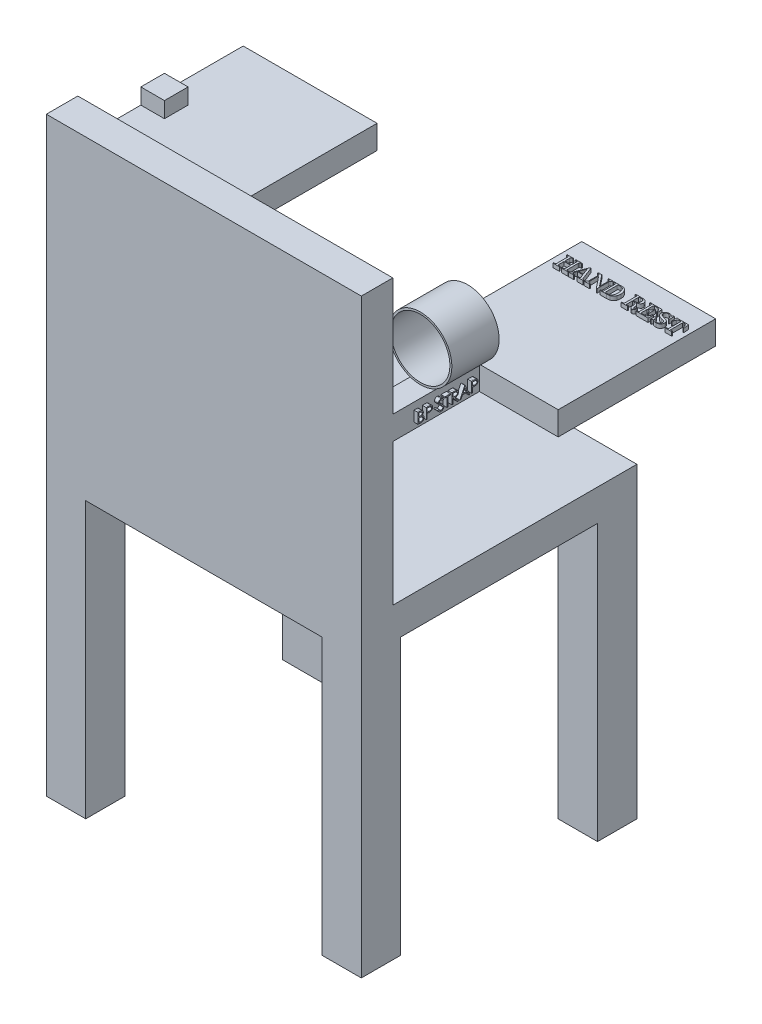
from build123d import *

# Parameters (mm, degrees)
BOSS_EXTRUDE1_DEPTH  = 40
SKETCH1_3_W          = 31
SKETCH1_3_H          = 3
BOSS_EXTRUDE2_DEPTH  = 3
SKETCH1_4_W          = 5
SKETCH1_4_H          = 35
BOSS_EXTRUDE3_DEPTH  = 5
SKETCH2_W            = 31
SKETCH2_H            = 3
BOSS_EXTRUDE4_DEPTH  = 3
SKETCH2_3_W          = 5
SKETCH2_3_H          = 35
BOSS_EXTRUDE5_DEPTH  = 5
SKETCH3_W            = 17
SKETCH3_H            = 3
BOSS_EXTRUDE6_DEPTH  = 20
SKETCH4_R            = 4
SKETCH4_R_2          = 3.75
BOSS_EXTRUDE7_DEPTH  = 6
SKETCH5_W            = 3
SKETCH5_H            = 3
BOSS_EXTRUDE8_DEPTH  = 2
BOSS_EXTRUDE9_DEPTH  = 0.5
BOSS_EXTRUDE10_DEPTH = 0.5
BOSS_EXTRUDE11_DEPTH = 0.5


with BuildPart() as part:
    # Sketch1 → Boss-Extrude1 (new body)
    with BuildSketch(Plane(origin=(0, 0, 0), x_dir=(0, 0, -1), z_dir=(1, 0, 0))):
        Polygon((35, 0), (0, 0), (0, 40), (4, 40), (4, 4), (35, 4), align=None)
    extrude(amount=-BOSS_EXTRUDE1_DEPTH)

    # Sketch1<3> → Boss-Extrude2 (add)
    with BuildSketch(Plane(origin=(0, 0, 0), x_dir=(0, 0, -1), z_dir=(1, 0, 0))):
        with Locations((19.5, 23.5)):
            Rectangle(SKETCH1_3_W, SKETCH1_3_H)
    extrude(amount=-BOSS_EXTRUDE2_DEPTH)

    # Sketch1<4> → Boss-Extrude3 (add)
    with BuildSketch(Plane(origin=(0, 0, 0), x_dir=(0, 0, -1), z_dir=(1, 0, 0))):
        with Locations((2.5, -17.5)):
            Rectangle(SKETCH1_4_W, SKETCH1_4_H)
        with Locations((32.5, -17.5)):
            Rectangle(SKETCH1_4_W, SKETCH1_4_H)
    extrude(amount=-BOSS_EXTRUDE3_DEPTH)

    # Sketch2 → Boss-Extrude4 (add)
    with BuildSketch(Plane.ZY.offset(40)):
        with Locations((-19.5, 23.5)):
            Rectangle(SKETCH2_W, SKETCH2_H)
    extrude(amount=-BOSS_EXTRUDE4_DEPTH)

    # Sketch2<3> → Boss-Extrude5 (add)
    with BuildSketch(Plane.ZY.offset(40)):
        with Locations((-2.5, -17.5)):
            Rectangle(SKETCH2_3_W, SKETCH2_3_H)
        with Locations((-32.5, -17.5)):
            Rectangle(SKETCH2_3_W, SKETCH2_3_H)
    extrude(amount=-BOSS_EXTRUDE5_DEPTH)

    # Sketch3 → Boss-Extrude6 (add)
    with BuildSketch(Plane(origin=(0, 0, -35), x_dir=(-1, 0, 0), z_dir=(0, 0, -1))):
        with Locations((-1.5, 23.5)):
            Rectangle(SKETCH3_W, SKETCH3_H)
        with Locations((41.5, 23.5)):
            Rectangle(SKETCH3_W, SKETCH3_H)
    extrude(amount=-BOSS_EXTRUDE6_DEPTH)

    # Sketch5 → Boss-Extrude8 (add)
    with BuildSketch(Plane(origin=(0, 25, 0), x_dir=(1, 0, 0), z_dir=(0, 1, 0))):
        with Locations((-48.5, 23.5)):
            Rectangle(SKETCH5_W, SKETCH5_H)
    extrude(amount=BOSS_EXTRUDE8_DEPTH)

    # Sketch6 → Boss-Extrude9 (add)
    # profile 1 of 8: a face of its own
    with BuildSketch(Plane(origin=(0, 25, 0), x_dir=(1, 0, 0), z_dir=(0, 1, 0))):
        with BuildLine():
            Line((-5.968465492, 32.119198843), (-5.148223591, 32.119198843))
            Line((-5.148223591, 32.119198843), (-5.148223591, 32.025456911))
            Line((-5.148223591, 32.025456911), (-5.300554229, 32.025456911))
            add(Edge.make_bspline(
                [(-5.300554229, 32.025456911), (-5.31276359, 32.025075742), (-5.334976596, 32.024382264), (-5.36525082, 32.02033003), (-5.388469306, 32.011635006), (-5.406906018, 31.999133181), (-5.417781934, 31.97801492), (-5.424363322, 31.949554747), (-5.428978515, 31.911954477), (-5.429281856, 31.883638248), (-5.429449385, 31.86799976)],
                knots=[0, 0, 0, 0, 1.196330601, 2.176534787, 2.970899887, 3.611337506, 4.301970399, 5.22941408, 6.469860787, 8, 8, 8, 8], degree=3))
            Line((-5.429449385, 31.86799976), (-5.429449385, 31.298956942))
            Line((-5.429449385, 31.298956942), (-4.585772002, 31.298956942))
            Line((-4.585772002, 31.298956942), (-4.585772002, 31.86799976))
            add(Edge.make_bspline(
                [(-4.585772002, 31.86799976), (-4.585834617, 31.876545291), (-4.585953644, 31.892789728), (-4.58703962, 31.915876362), (-4.588806742, 31.936411199), (-4.591293862, 31.954272378), (-4.594466302, 31.969657924), (-4.598803538, 31.982264883), (-4.603572998, 31.992552856), (-4.611112424, 32.003562811), (-4.62676914, 32.013359713), (-4.651326658, 32.020380369), (-4.683503896, 32.024976335), (-4.707570088, 32.025285673), (-4.720892208, 32.025456911)],
                knots=[0, 0, 0, 0, 1.2151787, 2.309967099, 3.285877721, 4.145051154, 4.873670585, 5.515913795, 6.036072613, 6.484028153, 7.394119881, 8.579807171, 10.106712673, 12, 12, 12, 12], degree=3))
            Line((-4.720892208, 32.025456911), (-4.866997796, 32.025456911))
            Line((-4.866997796, 32.025456911), (-4.866997796, 32.119198843))
            Line((-4.866997796, 32.119198843), (-4.046755895, 32.119198843))
            Line((-4.046755895, 32.119198843), (-4.046755895, 32.025456911))
            Line((-4.046755895, 32.025456911), (-4.200917431, 32.025456911))
            add(Edge.make_bspline(
                [(-4.200917431, 32.025456911), (-4.209831791, 32.025365413), (-4.226241209, 32.025196986), (-4.248752916, 32.022831642), (-4.266933863, 32.018465088), (-4.281775285, 32.012769044), (-4.293209958, 32.003834748), (-4.303846509, 31.993655202), (-4.312358171, 31.980083655), (-4.317327476, 31.970203353), (-4.319925743, 31.965037307)],
                knots=[0, 0, 0, 0, 1.484347156, 2.732363773, 3.757764418, 4.595822567, 5.351989597, 6.156854004, 7.036286714, 8, 8, 8, 8], degree=3))
            add(Edge.make_bspline(
                [(-4.319925743, 31.965037307), (-4.321297286, 31.96018132), (-4.324773994, 31.947871936), (-4.325813648, 31.924365785), (-4.32820832, 31.892707692), (-4.328062856, 31.868622511), (-4.32798169, 31.855183481)],
                knots=[0, 0, 0, 0, 0.546714553, 1.38586037, 2.541364415, 4, 4, 4, 4], degree=3))
            Line((-4.32798169, 31.855183481), (-4.32798169, 30.541697901))
            add(Edge.make_bspline(
                [(-4.32798169, 30.541697901), (-4.327855721, 30.527389772), (-4.32763133, 30.501902478), (-4.324316864, 30.468600904), (-4.320208892, 30.443707025), (-4.313225033, 30.43186524), (-4.310405078, 30.427083743)],
                knots=[0, 0, 0, 0, 1.461299395, 2.603035421, 3.435931139, 4, 4, 4, 4], degree=3))
            add(Edge.make_bspline(
                [(-4.310405078, 30.427083743), (-4.303770544, 30.420525051), (-4.289698405, 30.406613776), (-4.259870301, 30.394052982), (-4.223949387, 30.386001843), (-4.197560065, 30.385333324), (-4.183340819, 30.384973109)],
                knots=[0, 0, 0, 0, 0.805554503, 1.70861678, 2.765343721, 4, 4, 4, 4], degree=3))
            Line((-4.183340819, 30.384973109), (-4.046755895, 30.384973109))
            Line((-4.046755895, 30.384973109), (-4.046755895, 30.291231178))
            Line((-4.046755895, 30.291231178), (-4.866997796, 30.291231178))
            Line((-4.866997796, 30.291231178), (-4.866997796, 30.384973109))
            Line((-4.866997796, 30.384973109), (-4.720892208, 30.384973109))
            add(Edge.make_bspline(
                [(-4.720892208, 30.384973109), (-4.707525066, 30.385322001), (-4.68293807, 30.38596374), (-4.649441754, 30.394036936), (-4.621941895, 30.407169454), (-4.609347948, 30.421154225), (-4.603348614, 30.427816101)],
                knots=[0, 0, 0, 0, 1.234868951, 2.271369432, 3.176538416, 4, 4, 4, 4], degree=3))
            add(Edge.make_bspline(
                [(-4.603348614, 30.427816101), (-4.600529739, 30.433218362), (-4.593591599, 30.446515028), (-4.589471995, 30.47336282), (-4.58613348, 30.508872807), (-4.585901482, 30.53581548), (-4.585772002, 30.550852386)],
                knots=[0, 0, 0, 0, 0.579653831, 1.426710765, 2.563828101, 4, 4, 4, 4], degree=3))
            Line((-4.585772002, 30.550852386), (-4.585772002, 31.181779527))
            Line((-4.585772002, 31.181779527), (-5.429449385, 31.181779527))
            Line((-5.429449385, 31.181779527), (-5.429449385, 30.540965542))
            add(Edge.make_bspline(
                [(-5.429449385, 30.540965542), (-5.429295296, 30.526537463), (-5.429020654, 30.500821571), (-5.42600134, 30.467316834), (-5.422671377, 30.442392162), (-5.416268148, 30.430415605), (-5.41370367, 30.425619025)],
                knots=[0, 0, 0, 0, 1.471082981, 2.621985256, 3.448108571, 4, 4, 4, 4], degree=3))
            add(Edge.make_bspline(
                [(-5.41370367, 30.425619025), (-5.407566656, 30.419192028), (-5.394889471, 30.405915828), (-5.367908881, 30.393857672), (-5.33616164, 30.386138319), (-5.312941976, 30.385378483), (-5.300554229, 30.384973109)],
                knots=[0, 0, 0, 0, 0.852008306, 1.759987196, 2.804947734, 4, 4, 4, 4], degree=3))
            Line((-5.300554229, 30.384973109), (-5.148223591, 30.384973109))
            Line((-5.148223591, 30.384973109), (-5.148223591, 30.291231178))
            Line((-5.148223591, 30.291231178), (-5.968465492, 30.291231178))
            Line((-5.968465492, 30.291231178), (-5.968465492, 30.384973109))
            Line((-5.968465492, 30.384973109), (-5.802586214, 30.384973109))
            add(Edge.make_bspline(
                [(-5.802586214, 30.384973109), (-5.795621315, 30.385204849), (-5.782357178, 30.38564618), (-5.763574956, 30.388359091), (-5.747100475, 30.393663539), (-5.728226137, 30.402674718), (-5.708081139, 30.419507442), (-5.698867761, 30.437656764), (-5.694197106, 30.446857431)],
                knots=[0, 0, 0, 0, 0.941670479, 1.793341798, 2.555099784, 3.270803423, 4.616453614, 6, 6, 6, 6], degree=3))
            add(Edge.make_bspline(
                [(-5.694197106, 30.446857431), (-5.693124086, 30.451480071), (-5.690384897, 30.463280676), (-5.688819104, 30.485534795), (-5.687229477, 30.515793967), (-5.687236036, 30.538762749), (-5.687239697, 30.551584745)],
                knots=[0, 0, 0, 0, 0.540786502, 1.380511552, 2.537707791, 4, 4, 4, 4], degree=3))
            Line((-5.687239697, 30.551584745), (-5.687239697, 31.869830658))
            add(Edge.make_bspline(
                [(-5.687239697, 31.869830658), (-5.687420438, 31.885346397), (-5.68774603, 31.91329705), (-5.692198703, 31.950607169), (-5.699461149, 31.978845586), (-5.711458145, 31.999604421), (-5.730487404, 32.012135875), (-5.754988203, 32.020195609), (-5.786701752, 32.024452106), (-5.810143332, 32.025099369), (-5.823092262, 32.025456911)],
                knots=[0, 0, 0, 0, 1.491979336, 2.687709435, 3.605468844, 4.286305042, 4.934674421, 5.744279776, 6.753959201, 8, 8, 8, 8], degree=3))
            Line((-5.823092262, 32.025456911), (-5.968465492, 32.025456911))
            Line((-5.968465492, 32.025456911), (-5.968465492, 32.119198843))
        make_face()
    # profile 2 of 8: a face of its own
    with BuildSketch(Plane(origin=(0, 25, 0), x_dir=(1, 0, 0), z_dir=(0, 1, 0))):
        with BuildLine():
            Line((-3.086633456, 32.142634325), (-2.975681092, 32.142634325))
            Line((-2.975681092, 32.142634325), (-2.343655413, 30.487503347))
            add(Edge.make_bspline(
                [(-2.343655413, 30.487503347), (-2.340119687, 30.479316954), (-2.333329399, 30.463595157), (-2.319263431, 30.442533351), (-2.302978804, 30.424379047), (-2.283425862, 30.410143529), (-2.261956355, 30.398230295), (-2.237301345, 30.391092231), (-2.210497085, 30.385469099), (-2.191603723, 30.385142506), (-2.181804109, 30.384973109)],
                knots=[0, 0, 0, 0, 1.039787226, 1.996889935, 2.945563617, 3.872445737, 4.810232727, 5.797866669, 6.857796924, 8, 8, 8, 8], degree=3))
            Line((-2.181804109, 30.384973109), (-2.125046299, 30.384973109))
            Line((-2.125046299, 30.384973109), (-2.125046299, 30.291231178))
            Line((-2.125046299, 30.291231178), (-2.874981751, 30.291231178))
            Line((-2.874981751, 30.291231178), (-2.874981751, 30.384973109))
            Line((-2.874981751, 30.384973109), (-2.815294506, 30.384973109))
            add(Edge.make_bspline(
                [(-2.815294506, 30.384973109), (-2.797207981, 30.385148678), (-2.763768891, 30.385473276), (-2.718033615, 30.390334894), (-2.680241054, 30.396957613), (-2.65919878, 30.405880094), (-2.649781408, 30.40987331)],
                knots=[0, 0, 0, 0, 1.28614417, 2.377874675, 3.274025287, 4, 4, 4, 4], degree=3))
            add(Edge.make_bspline(
                [(-2.649781408, 30.40987331), (-2.644839345, 30.412929028), (-2.635241357, 30.418863543), (-2.624172798, 30.431557313), (-2.618142241, 30.447113653), (-2.617274944, 30.458037696), (-2.61682526, 30.463701685)],
                knots=[0, 0, 0, 0, 1.044845995, 2.029197152, 2.978161746, 4, 4, 4, 4], degree=3))
            add(Edge.make_bspline(
                [(-2.61682526, 30.463701685), (-2.617224612, 30.471091492), (-2.618059765, 30.48654557), (-2.623264042, 30.501130843), (-2.625979745, 30.508741753)],
                knots=[0, 0, 0, 0, 0.9563569, 2, 2, 2, 2], degree=3))
            Line((-2.625979745, 30.508741753), (-2.775747128, 30.900553733))
            Line((-2.775747128, 30.900553733), (-3.477713076, 30.900553733))
            Line((-3.477713076, 30.900553733), (-3.566328496, 30.675719569))
            add(Edge.make_bspline(
                [(-3.566328496, 30.675719569), (-3.57126897, 30.661616439), (-3.58051843, 30.635212826), (-3.590845527, 30.597317026), (-3.597630097, 30.564028592), (-3.598764894, 30.543187433), (-3.599284644, 30.533641954)],
                knots=[0, 0, 0, 0, 1.224040328, 2.291625076, 3.217545626, 4, 4, 4, 4], degree=3))
            add(Edge.make_bspline(
                [(-3.599284644, 30.533641954), (-3.598559182, 30.523663351), (-3.597130435, 30.50401117), (-3.586180325, 30.47570826), (-3.567961186, 30.450307595), (-3.543615011, 30.426899914), (-3.512066905, 30.40781642), (-3.473907357, 30.394597637), (-3.429760655, 30.385965397), (-3.398176457, 30.385317231), (-3.381407889, 30.384973109)],
                knots=[0, 0, 0, 0, 0.81354721, 1.602226087, 2.440081589, 3.349586742, 4.342853265, 5.424428202, 6.632586778, 8, 8, 8, 8], degree=3))
            Line((-3.381407889, 30.384973109), (-3.320255926, 30.384973109))
            Line((-3.320255926, 30.384973109), (-3.320255926, 30.291231178))
            Line((-3.320255926, 30.291231178), (-3.976449447, 30.291231178))
            Line((-3.976449447, 30.291231178), (-3.976449447, 30.384973109))
            add(Edge.make_bspline(
                [(-3.976449447, 30.384973109), (-3.959440201, 30.385472853), (-3.927001175, 30.386425936), (-3.881050984, 30.3952723), (-3.840503548, 30.40971315), (-3.804693203, 30.431105323), (-3.772654512, 30.461246139), (-3.744013024, 30.501671949), (-3.715400905, 30.551555182), (-3.699654977, 30.589449198), (-3.691195678, 30.609807273)],
                knots=[0, 0, 0, 0, 1.036060294, 1.975912788, 2.839911673, 3.647735987, 4.500737518, 5.500873586, 6.657376306, 8, 8, 8, 8], degree=3))
            Line((-3.691195678, 30.609807273), (-3.086633456, 32.142634325))
        make_face()
        Polygon((-3.121054321, 31.8050169), (-3.440728955, 30.994295664), (-2.811632711, 30.994295664), align=None, mode=Mode.SUBTRACT)
    # profile 3 of 8: a face of its own
    with BuildSketch(Plane(origin=(0, 25, 0), x_dir=(1, 0, 0), z_dir=(0, 1, 0))):
        with BuildLine():
            Line((-2.007868884, 32.119198843), (-1.582734578, 32.119198843))
            Line((-1.582734578, 32.119198843), (-0.437691531, 30.683043157))
            Line((-0.437691531, 30.683043157), (-0.437691531, 31.721527992))
            add(Edge.make_bspline(
                [(-0.437691531, 31.721527992), (-0.437894326, 31.73422835), (-0.438287, 31.758820165), (-0.441516635, 31.794329292), (-0.447184181, 31.827182907), (-0.454122291, 31.857743278), (-0.46427052, 31.885544179), (-0.475672593, 31.911141835), (-0.490228366, 31.933679156), (-0.501393677, 31.947078398), (-0.506899442, 31.953685745)],
                knots=[0, 0, 0, 0, 1.230117456, 2.381887384, 3.448986677, 4.458394355, 5.411972479, 6.311230481, 7.167245012, 8, 8, 8, 8], degree=3))
            add(Edge.make_bspline(
                [(-0.506899442, 31.953685745), (-0.5123998, 31.959179963), (-0.523447824, 31.970215654), (-0.542284775, 31.984669789), (-0.563297484, 31.996475182), (-0.585744409, 32.00716143), (-0.610628742, 32.014544532), (-0.637164304, 32.02044954), (-0.665731617, 32.024075721), (-0.685341364, 32.024986127), (-0.695481843, 32.025456911)],
                knots=[0, 0, 0, 0, 0.898793161, 1.805316593, 2.735288467, 3.682991866, 4.674390921, 5.729595408, 6.825941524, 8, 8, 8, 8], degree=3))
            Line((-0.695481843, 32.025456911), (-0.695481843, 32.119198843))
            Line((-0.695481843, 32.119198843), (-0.086159288, 32.119198843))
            Line((-0.086159288, 32.119198843), (-0.086159288, 32.025456911))
            add(Edge.make_bspline(
                [(-0.086159288, 32.025456911), (-0.100933873, 32.025060336), (-0.128616254, 32.024317295), (-0.167465276, 32.020107111), (-0.200144495, 32.011258185), (-0.228191783, 31.99963067), (-0.251260767, 31.981768556), (-0.27304882, 31.960030196), (-0.291898505, 31.931578714), (-0.310084005, 31.899220512), (-0.325459247, 31.863116284), (-0.335774915, 31.824371627), (-0.342784943, 31.784153313), (-0.343557162, 31.75671195), (-0.3439496, 31.742766399)],
                knots=[0, 0, 0, 0, 1.217066592, 2.280355179, 3.206739743, 3.998574125, 4.760374727, 5.591842129, 6.523011432, 7.557704248, 8.647728119, 9.742467328, 10.852734229, 12, 12, 12, 12], degree=3))
            Line((-0.3439496, 31.742766399), (-0.3439496, 30.291231178))
            Line((-0.3439496, 30.291231178), (-0.447944555, 30.291231178))
            Line((-0.447944555, 30.291231178), (-1.632901158, 31.777187264))
            Line((-1.632901158, 31.777187264), (-1.632901158, 30.681944619))
            add(Edge.make_bspline(
                [(-1.632901158, 30.681944619), (-1.632773983, 30.669967778), (-1.632526624, 30.646672592), (-1.628221318, 30.61303585), (-1.622219623, 30.5815984), (-1.613347864, 30.552706474), (-1.602496563, 30.525847863), (-1.588334853, 30.501729883), (-1.572324502, 30.47947445), (-1.553294412, 30.459820697), (-1.531658657, 30.442539151), (-1.507084844, 30.427969888), (-1.480221458, 30.414960712), (-1.450352446, 30.404470214), (-1.417788962, 30.395991414), (-1.382442691, 30.390468343), (-1.344570543, 30.386208412), (-1.318366004, 30.38539439), (-1.304804398, 30.384973109)],
                knots=[0, 0, 0, 0, 1.132161994, 2.20207693, 3.203032259, 4.156433577, 5.05712018, 5.936533618, 6.795699735, 7.645032216, 8.516066469, 9.40722803, 10.342057337, 11.335524784, 12.396994126, 13.520822377, 14.716953971, 16, 16, 16, 16], degree=3))
            Line((-1.304804398, 30.384973109), (-1.304804398, 30.291231178))
            Line((-1.304804398, 30.291231178), (-2.007868884, 30.291231178))
            Line((-2.007868884, 30.291231178), (-2.007868884, 30.384973109))
            add(Edge.make_bspline(
                [(-2.007868884, 30.384973109), (-1.997354455, 30.385515038), (-1.976714048, 30.386578875), (-1.946664542, 30.391379238), (-1.918374997, 30.398725013), (-1.891788658, 30.408320541), (-1.866834843, 30.419978763), (-1.843491243, 30.434051306), (-1.821768647, 30.450518599), (-1.795838007, 30.475847991), (-1.767769674, 30.51092926), (-1.744047648, 30.559040136), (-1.729189225, 30.611369991), (-1.727503573, 30.647911546), (-1.72664309, 30.666565083)],
                knots=[0, 0, 0, 0, 0.853114045, 1.674710168, 2.4619767, 3.219512304, 3.963218819, 4.691289018, 5.425587017, 6.167447776, 7.626443585, 9.042626066, 10.490335557, 12, 12, 12, 12], degree=3))
            Line((-1.72664309, 30.666565083), (-1.72664309, 31.895097038))
            Line((-1.72664309, 31.895097038), (-1.751177111, 31.926222288))
            add(Edge.make_bspline(
                [(-1.751177111, 31.926222288), (-1.759727052, 31.936705058), (-1.775215031, 31.955694302), (-1.797480674, 31.979695142), (-1.815499091, 31.997620986), (-1.827712125, 32.005106523), (-1.832835122, 32.008246478)],
                knots=[0, 0, 0, 0, 1.394610819, 2.526298507, 3.381826945, 4, 4, 4, 4], degree=3))
            add(Edge.make_bspline(
                [(-1.832835122, 32.008246478), (-1.839108924, 32.011028831), (-1.852166436, 32.016819673), (-1.874291082, 32.021468258), (-1.898756095, 32.024948401), (-1.916063876, 32.025282332), (-1.925112335, 32.025456911)],
                knots=[0, 0, 0, 0, 0.868179485, 1.806920966, 2.85346449, 4, 4, 4, 4], degree=3))
            Line((-1.925112335, 32.025456911), (-2.007868884, 32.025456911))
            Line((-2.007868884, 32.025456911), (-2.007868884, 32.119198843))
        make_face()
    # profile 4 of 8: a face of its own
    with BuildSketch(Plane(origin=(0, 25, 0), x_dir=(1, 0, 0), z_dir=(0, 1, 0))):
        with BuildLine():
            Line((0.031018127, 32.119198843), (0.972099236, 32.119198843))
            add(Edge.make_bspline(
                [(0.972099236, 32.119198843), (0.989195283, 32.119030174), (1.022818174, 32.118698452), (1.072300688, 32.11482708), (1.119858613, 32.109112829), (1.165438366, 32.100979382), (1.209072342, 32.090958223), (1.25055178, 32.077901032), (1.290369641, 32.063157717), (1.315542665, 32.050928651), (1.328025632, 32.04486442)],
                knots=[0, 0, 0, 0, 1.117997266, 2.198771569, 3.244505109, 4.249964674, 5.225989755, 6.17045059, 7.0927508, 8, 8, 8, 8], degree=3))
            add(Edge.make_bspline(
                [(1.328025632, 32.04486442), (1.343057966, 32.03668263), (1.373380212, 32.020178853), (1.416579369, 31.990820073), (1.457595821, 31.95696902), (1.497887645, 31.920300095), (1.535174053, 31.878467509), (1.571924955, 31.83379489), (1.606044208, 31.784588611), (1.638598302, 31.732003586), (1.668656551, 31.676501392), (1.694300567, 31.617735579), (1.716258003, 31.556707594), (1.734235001, 31.493084789), (1.748174878, 31.427018093), (1.757810456, 31.358374889), (1.764442833, 31.287247141), (1.764974024, 31.238919218), (1.76524386, 31.214369496)],
                knots=[0, 0, 0, 0, 0.833082016, 1.680438849, 2.538176053, 3.421420561, 4.330214496, 5.264067045, 6.236958324, 7.243141623, 8.2749117, 9.307503224, 10.362232928, 11.430954548, 12.524413756, 13.647423916, 14.804933345, 16, 16, 16, 16], degree=3))
            add(Edge.make_bspline(
                [(1.76524386, 31.214369496), (1.76507553, 31.193978981), (1.764743624, 31.153773995), (1.760831342, 31.094294679), (1.755151265, 31.036358978), (1.746727596, 30.979894819), (1.735675473, 30.924942213), (1.722518857, 30.871544883), (1.707311903, 30.819614869), (1.694889238, 30.78611735), (1.688712361, 30.7694615)],
                knots=[0, 0, 0, 0, 1.077752757, 2.125058456, 3.149778305, 4.154495193, 5.141548337, 6.111839545, 7.061156861, 8, 8, 8, 8], degree=3))
            add(Edge.make_bspline(
                [(1.688712361, 30.7694615), (1.678264091, 30.744671425), (1.657482029, 30.695362891), (1.616698101, 30.625876159), (1.567560067, 30.5617898), (1.511645553, 30.50215855), (1.448085329, 30.449119102), (1.377902487, 30.402642509), (1.301203739, 30.36307825), (1.246375617, 30.343355535), (1.218537986, 30.333341811)],
                knots=[0, 0, 0, 0, 0.97266033, 1.934663506, 2.905446935, 3.889590833, 4.886544553, 5.89344674, 6.930449359, 8, 8, 8, 8], degree=3))
            add(Edge.make_bspline(
                [(1.218537986, 30.333341811), (1.207348995, 30.329894534), (1.184185545, 30.322757981), (1.147629964, 30.314752709), (1.108609833, 30.307173604), (1.066773874, 30.301557966), (1.022221655, 30.296709882), (0.974947303, 30.293486581), (0.925119918, 30.291725145), (0.891052919, 30.291398533), (0.873596972, 30.291231178)],
                knots=[0, 0, 0, 0, 0.805217408, 1.666961051, 2.572873821, 3.539648437, 4.570025201, 5.656022224, 6.798944616, 8, 8, 8, 8], degree=3))
            Line((0.873596972, 30.291231178), (0.031018127, 30.291231178))
            Line((0.031018127, 30.291231178), (0.031018127, 30.384973109))
            Line((0.031018127, 30.384973109), (0.19909448, 30.384973109))
            add(Edge.make_bspline(
                [(0.19909448, 30.384973109), (0.208869234, 30.385283513), (0.226910698, 30.38585643), (0.251757229, 30.389167177), (0.271919676, 30.395481374), (0.287611913, 30.405011043), (0.299090921, 30.417650757), (0.306689706, 30.433168299), (0.311705086, 30.451310022), (0.312056194, 30.464395177), (0.312243921, 30.471391452)],
                knots=[0, 0, 0, 0, 1.425691273, 2.631427591, 3.644559092, 4.484131817, 5.277931106, 6.097840766, 6.982967324, 8, 8, 8, 8], degree=3))
            Line((0.312243921, 30.471391452), (0.312243921, 31.941601824))
            add(Edge.make_bspline(
                [(0.312243921, 31.941601824), (0.312036164, 31.947624019), (0.311629251, 31.959419071), (0.306336985, 31.975901296), (0.297960876, 31.990642113), (0.286057485, 32.002827053), (0.271728054, 32.013565849), (0.254058153, 32.020105593), (0.234251578, 32.024817182), (0.22012285, 32.02523547), (0.212643119, 32.025456911)],
                knots=[0, 0, 0, 0, 0.980641448, 1.920681157, 2.796522487, 3.727845141, 4.685496402, 5.696699711, 6.780635719, 8, 8, 8, 8], degree=3))
            Line((0.212643119, 32.025456911), (0.031018127, 32.025456911))
            Line((0.031018127, 32.025456911), (0.031018127, 32.119198843))
        make_face()
        with BuildLine():
            add(Edge.make_bspline(
                [(0.6791557, 32.025456911), (0.670465486, 32.025223871), (0.654177982, 32.024787099), (0.631440239, 32.020354204), (0.61208413, 32.013334655), (0.596405736, 32.00270098), (0.584336713, 31.989111697), (0.575707936, 31.972545094), (0.571133059, 31.95294682), (0.570414416, 31.939060992), (0.570034233, 31.93171498)],
                knots=[0, 0, 0, 0, 1.263472642, 2.368044857, 3.357919552, 4.240039874, 5.095822289, 5.977942611, 6.930271981, 8, 8, 8, 8], degree=3))
            Line((0.570034233, 31.93171498), (0.570034233, 30.475053247))
            add(Edge.make_bspline(
                [(0.570034233, 30.475053247), (0.570301394, 30.468044868), (0.570809228, 30.454722935), (0.577010048, 30.435992429), (0.58700289, 30.41998569), (0.601206321, 30.406494658), (0.620435217, 30.396518808), (0.644630935, 30.390030589), (0.673869313, 30.38558633), (0.69512515, 30.385188328), (0.706619157, 30.384973109)],
                knots=[0, 0, 0, 0, 0.89930401, 1.709449408, 2.507459987, 3.307943107, 4.201045422, 5.265394816, 6.521273367, 8, 8, 8, 8], degree=3))
            Line((0.706619157, 30.384973109), (0.862977769, 30.384973109))
            add(Edge.make_bspline(
                [(0.862977769, 30.384973109), (0.880196759, 30.38538645), (0.914210854, 30.386202955), (0.964429116, 30.390826149), (1.01298558, 30.39938401), (1.059875909, 30.411048466), (1.105263204, 30.426036987), (1.148668456, 30.444911074), (1.190935505, 30.466345798), (1.21734241, 30.483591278), (1.230621907, 30.492263679)],
                knots=[0, 0, 0, 0, 1.062848101, 2.099531771, 3.108895551, 4.10282061, 5.079524816, 6.054833563, 7.021815301, 8, 8, 8, 8], degree=3))
            add(Edge.make_bspline(
                [(1.230621907, 30.492263679), (1.247341649, 30.504912636), (1.280853887, 30.530265587), (1.322785245, 30.5784516), (1.359962851, 30.632424687), (1.378079304, 30.672937964), (1.387346698, 30.69366236)],
                knots=[0, 0, 0, 0, 0.97036836, 1.94495903, 2.948752459, 4, 4, 4, 4], degree=3))
            add(Edge.make_bspline(
                [(1.387346698, 30.69366236), (1.393301481, 30.70884275), (1.40563285, 30.740278823), (1.420391452, 30.790513055), (1.432716278, 30.844849809), (1.442954037, 30.903270609), (1.45086889, 30.965841185), (1.45678132, 31.032647188), (1.459962738, 31.103629629), (1.46037227, 31.152360165), (1.460582582, 31.177385374)],
                knots=[0, 0, 0, 0, 0.794791685, 1.645881885, 2.549653267, 3.510508143, 4.536608563, 5.623965425, 6.779804852, 8, 8, 8, 8], degree=3))
            add(Edge.make_bspline(
                [(1.460582582, 31.177385374), (1.460068706, 31.214134652), (1.459074013, 31.285268885), (1.452088837, 31.388152364), (1.438987235, 31.483318872), (1.42241309, 31.57113578), (1.399641458, 31.651214845), (1.372190094, 31.723823874), (1.340247246, 31.78934456), (1.313265182, 31.8277789), (1.300195996, 31.846395175)],
                knots=[0, 0, 0, 0, 1.261482698, 2.441805943, 3.536837969, 4.55738863, 5.506995227, 6.390187172, 7.220261963, 8, 8, 8, 8], degree=3))
            add(Edge.make_bspline(
                [(1.300195996, 31.846395175), (1.288494649, 31.860787756), (1.26532395, 31.889287563), (1.223936481, 31.925656323), (1.178585104, 31.956684252), (1.128786123, 31.982144879), (1.074553346, 32.001414419), (1.016128016, 32.015331777), (0.953426911, 32.023800485), (0.910119765, 32.024894859), (0.887877969, 32.025456911)],
                knots=[0, 0, 0, 0, 0.952473484, 1.886062724, 2.820980377, 3.772626199, 4.753467373, 5.773493743, 6.856505225, 8, 8, 8, 8], degree=3))
            Line((0.887877969, 32.025456911), (0.6791557, 32.025456911))
        make_face(mode=Mode.SUBTRACT)
    # profile 5 of 8: a face of its own
    with BuildSketch(Plane(origin=(0, 25, 0), x_dir=(1, 0, 0), z_dir=(0, 1, 0))):
        with BuildLine():
            Line((2.702663175, 32.119198843), (3.633491261, 32.119198843))
            add(Edge.make_bspline(
                [(3.633491261, 32.119198843), (3.655476382, 32.118899257), (3.698187395, 32.118317246), (3.760351538, 32.112326956), (3.81867097, 32.102662881), (3.873127794, 32.088629107), (3.923969931, 32.071174206), (3.971034407, 32.049599413), (4.014263713, 32.02381413), (4.053302024, 31.994063184), (4.088598854, 31.961629864), (4.119087161, 31.926302015), (4.145085776, 31.888705284), (4.165985793, 31.848398683), (4.182653634, 31.805723658), (4.194234237, 31.760476713), (4.201434827, 31.71285004), (4.202162438, 31.680298151), (4.20253408, 31.663671644)],
                knots=[0, 0, 0, 0, 1.283879857, 2.49422373, 3.644109154, 4.733564, 5.775312755, 6.780226247, 7.752329523, 8.709173768, 9.642539369, 10.547364715, 11.429401853, 12.306410462, 13.193533583, 14.099706314, 15.029388263, 16, 16, 16, 16], degree=3))
            add(Edge.make_bspline(
                [(4.20253408, 31.663671644), (4.201932425, 31.643832142), (4.200751348, 31.604886266), (4.188409076, 31.548352736), (4.169436337, 31.494970815), (4.142519518, 31.445401888), (4.108449933, 31.399925545), (4.067558559, 31.359043336), (4.019587858, 31.323344792), (3.974574444, 31.297634668), (3.933907298, 31.279922298), (3.89906112, 31.26692189), (3.859745466, 31.255952025), (3.816517187, 31.245321875), (3.769272868, 31.235421681), (3.717961227, 31.226734559), (3.662525781, 31.218991158), (3.624106785, 31.214982293), (3.604196907, 31.212904778)],
                knots=[0, 0, 0, 0, 1.137224841, 2.232425953, 3.305140778, 4.380461003, 5.456671101, 6.556546416, 7.687407718, 8.879760467, 9.522878125, 10.232239294, 11.012772474, 11.864150045, 12.787583039, 13.782812018, 14.85098657, 16, 16, 16, 16], degree=3))
            add(Edge.make_bspline(
                [(3.604196907, 31.212904778), (3.618499927, 31.208951634), (3.646089919, 31.201326166), (3.685455594, 31.189145734), (3.721633239, 31.177642901), (3.754002501, 31.165468316), (3.783146778, 31.153816562), (3.80876232, 31.142231506), (3.830907105, 31.130497987), (3.855645195, 31.115062681), (3.882519752, 31.093632156), (3.91183839, 31.065560566), (3.937026274, 31.033276905), (3.95585616, 31.003545945), (3.96944605, 30.976064788), (3.97913661, 30.950316157), (3.989398047, 30.920221796), (3.999185749, 30.88508902), (4.008932422, 30.845372314), (4.018875034, 30.800820357), (4.028651055, 30.751597941), (4.034878167, 30.717107902), (4.03811952, 30.699155052)],
                knots=[0, 0, 0, 0, 1.206438829, 2.327175689, 3.350287853, 4.292307306, 5.138200021, 5.902044599, 6.576893256, 7.174411928, 8.270266093, 9.365086199, 10.467079651, 11.590581327, 12.220829487, 12.956161795, 13.825482602, 14.805624267, 15.920059975, 17.150426224, 18.516732029, 20, 20, 20, 20], degree=3))
            add(Edge.make_bspline(
                [(4.03811952, 30.699155052), (4.040423543, 30.686187542), (4.044898443, 30.661001897), (4.053660958, 30.624866365), (4.061915637, 30.591172945), (4.072323339, 30.560627277), (4.081964696, 30.532420751), (4.093743255, 30.507514269), (4.105118517, 30.484776371), (4.114262544, 30.471306162), (4.118678993, 30.464800223)],
                knots=[0, 0, 0, 0, 1.265772579, 2.458397796, 3.57407367, 4.598249002, 5.559666784, 6.436597769, 7.244896572, 8, 8, 8, 8], degree=3))
            add(Edge.make_bspline(
                [(4.118678993, 30.464800223), (4.125232044, 30.4563628), (4.137377356, 30.440725026), (4.15863074, 30.422422159), (4.181200163, 30.410741919), (4.197044148, 30.409170834), (4.204731156, 30.408408592)],
                knots=[0, 0, 0, 0, 1.199130811, 2.222448485, 3.137587403, 4, 4, 4, 4], degree=3))
            add(Edge.make_bspline(
                [(4.204731156, 30.408408592), (4.212674574, 30.409263554), (4.22898791, 30.411019384), (4.252347419, 30.423659861), (4.273900887, 30.443890843), (4.290864486, 30.465966794), (4.303467255, 30.487866921), (4.312331854, 30.507977083), (4.319882362, 30.53106482), (4.326316214, 30.557180817), (4.332237376, 30.586107289), (4.336910885, 30.618018162), (4.340480688, 30.652849874), (4.342235313, 30.677056941), (4.343146977, 30.689634387)],
                knots=[0, 0, 0, 0, 0.841138524, 1.72743991, 2.754725145, 3.964622261, 4.666710373, 5.432135723, 6.292307162, 7.241054536, 8.285106602, 9.424516758, 10.661837121, 12, 12, 12, 12], degree=3))
            Line((4.343146977, 30.689634387), (4.413453426, 30.689634387))
            add(Edge.make_bspline(
                [(4.413453426, 30.689634387), (4.412295285, 30.672650675), (4.410039938, 30.639576824), (4.403713049, 30.591810628), (4.395765138, 30.547151001), (4.385678771, 30.505864195), (4.373139513, 30.467807403), (4.35865107, 30.433103081), (4.342011661, 30.401591422), (4.323542513, 30.373248089), (4.302303918, 30.348494636), (4.279399757, 30.32674389), (4.254009985, 30.308670494), (4.226911048, 30.293363227), (4.197177164, 30.282222035), (4.165720786, 30.273607245), (4.131995904, 30.268981786), (4.108926617, 30.268198249), (4.097074407, 30.267795695)],
                knots=[0, 0, 0, 0, 1.379193329, 2.685822633, 3.902295341, 5.05381776, 6.126696511, 7.14627144, 8.097589069, 9.011132489, 9.881232234, 10.734986358, 11.564030858, 12.400827998, 13.249467195, 14.130017788, 15.039267208, 16, 16, 16, 16], degree=3))
            add(Edge.make_bspline(
                [(4.097074407, 30.267795695), (4.082266371, 30.268362557), (4.053376537, 30.26946848), (4.011461654, 30.277989738), (3.97265583, 30.292487794), (3.936717013, 30.312126484), (3.905033242, 30.338231481), (3.877243325, 30.369448381), (3.853405449, 30.406041963), (3.841910949, 30.43346186), (3.83598848, 30.44758979)],
                knots=[0, 0, 0, 0, 1.047310067, 2.043256379, 3.010632594, 3.969450702, 4.927140125, 5.899707092, 6.917837227, 8, 8, 8, 8], degree=3))
            add(Edge.make_bspline(
                [(3.83598848, 30.44758979), (3.833710966, 30.454278535), (3.828464797, 30.469685809), (3.821733376, 30.496500931), (3.814931018, 30.530017654), (3.807537683, 30.570278629), (3.800513896, 30.617345888), (3.792622045, 30.671009935), (3.785118735, 30.731475338), (3.780063707, 30.774097467), (3.777399773, 30.796558777)],
                knots=[0, 0, 0, 0, 0.478390711, 1.10195509, 1.870434605, 2.794664839, 3.873792197, 5.093131774, 6.468118011, 8, 8, 8, 8], degree=3))
            add(Edge.make_bspline(
                [(3.777399773, 30.796558777), (3.775947993, 30.809760113), (3.773157807, 30.835131845), (3.766953633, 30.871554789), (3.761044962, 30.905098209), (3.753953305, 30.93573298), (3.746521773, 30.963437462), (3.737919916, 30.988027954), (3.729419214, 31.009933655), (3.716114569, 31.034693135), (3.696630224, 31.062717097), (3.667968845, 31.092566935), (3.633091227, 31.118183661), (3.593631169, 31.14104051), (3.548897782, 31.159194271), (3.499822189, 31.172247614), (3.446654686, 31.180555007), (3.40978804, 31.181362008), (3.390714306, 31.181779527)],
                knots=[0, 0, 0, 0, 1.028548164, 1.976773217, 2.861390999, 3.666484284, 4.412018593, 5.081814562, 5.684068578, 6.229699931, 7.255288488, 8.31854149, 9.419144819, 10.596629043, 11.843300618, 13.146114873, 14.523482561, 16, 16, 16, 16], degree=3))
            Line((3.390714306, 31.181779527), (3.241679282, 31.181779527))
            Line((3.241679282, 31.181779527), (3.241679282, 30.471757632))
            add(Edge.make_bspline(
                [(3.241679282, 30.471757632), (3.241899283, 30.464762885), (3.242309781, 30.451711438), (3.246828947, 30.433898093), (3.253498497, 30.418757311), (3.260842754, 30.411527099), (3.264382406, 30.408042413)],
                knots=[0, 0, 0, 0, 1.200674003, 2.240328943, 3.151905871, 4, 4, 4, 4], degree=3))
            add(Edge.make_bspline(
                [(3.264382406, 30.408042413), (3.269731188, 30.404341296), (3.280952464, 30.396576677), (3.302106327, 30.390092347), (3.326556434, 30.385635385), (3.344303971, 30.385202844), (3.353730184, 30.384973109)],
                knots=[0, 0, 0, 0, 0.826964289, 1.734898464, 2.796941306, 4, 4, 4, 4], degree=3))
            Line((3.353730184, 30.384973109), (3.522905076, 30.384973109))
            Line((3.522905076, 30.384973109), (3.522905076, 30.291231178))
            Line((3.522905076, 30.291231178), (2.702663175, 30.291231178))
            Line((2.702663175, 30.291231178), (2.702663175, 30.384973109))
            Line((2.702663175, 30.384973109), (2.874035144, 30.384973109))
            add(Edge.make_bspline(
                [(2.874035144, 30.384973109), (2.882846191, 30.385210535), (2.899373436, 30.385655885), (2.922369266, 30.390022506), (2.941848722, 30.397087118), (2.957408384, 30.407714958), (2.969374555, 30.420794886), (2.978002597, 30.436051271), (2.982811074, 30.45365738), (2.983517016, 30.465991352), (2.98388897, 30.472489991)],
                knots=[0, 0, 0, 0, 1.322849184, 2.481323038, 3.503366862, 4.414154492, 5.284122715, 6.146514873, 7.023418293, 8, 8, 8, 8], degree=3))
            Line((2.98388897, 30.472489991), (2.98388897, 31.93171498))
            add(Edge.make_bspline(
                [(2.98388897, 31.93171498), (2.983497509, 31.939054586), (2.982757548, 31.952928305), (2.978312909, 31.97266453), (2.969145672, 31.988996214), (2.957149869, 32.002854248), (2.941225778, 32.013118211), (2.92193554, 32.020517509), (2.899114069, 32.024724437), (2.882718871, 32.025203288), (2.874035144, 32.025456911)],
                knots=[0, 0, 0, 0, 1.066531836, 2.016015794, 2.903845426, 3.757070895, 4.651239732, 5.621644264, 6.74030242, 8, 8, 8, 8], degree=3))
            Line((2.874035144, 32.025456911), (2.702663175, 32.025456911))
            Line((2.702663175, 32.025456911), (2.702663175, 32.119198843))
        make_face()
        with BuildLine():
            Line((3.241679282, 31.275521459), (3.450401551, 31.275521459))
            add(Edge.make_bspline(
                [(3.450401551, 31.275521459), (3.467493965, 31.275858967), (3.500619983, 31.276513075), (3.548970874, 31.279951628), (3.59438439, 31.28681135), (3.637256953, 31.295117044), (3.676901464, 31.307147947), (3.713979171, 31.320840644), (3.747864197, 31.337886483), (3.779596128, 31.356677365), (3.807570511, 31.379623936), (3.832308892, 31.406203762), (3.85229626, 31.437583534), (3.869326833, 31.472384973), (3.881896125, 31.511418744), (3.89157839, 31.554142403), (3.896866185, 31.601044814), (3.89752963, 31.633632791), (3.897872802, 31.650489185)],
                knots=[0, 0, 0, 0, 1.219595185, 2.363641091, 3.454730401, 4.494761589, 5.475621669, 6.407157146, 7.310634959, 8.178322238, 9.032401173, 9.882921431, 10.757225062, 11.676345793, 12.640127146, 13.675298604, 14.79752949, 16, 16, 16, 16], degree=3))
            add(Edge.make_bspline(
                [(3.897872802, 31.650489185), (3.897282276, 31.673333092), (3.89616031, 31.716735164), (3.888605833, 31.778292149), (3.874329436, 31.832169818), (3.85499566, 31.878786661), (3.830493538, 31.917821562), (3.803058327, 31.950813588), (3.771302505, 31.976578297), (3.741380314, 31.992728253), (3.714131601, 32.002378354), (3.689199175, 32.008438573), (3.659997261, 32.013895816), (3.626248488, 32.01818541), (3.588240636, 32.021282174), (3.545884502, 32.023943228), (3.499112927, 32.025339504), (3.46639217, 32.02541663), (3.449303013, 32.025456911)],
                knots=[0, 0, 0, 0, 1.583904885, 3.009325589, 4.288147178, 5.437094785, 6.493769576, 7.47222241, 8.398684323, 9.311127006, 9.814333876, 10.39927682, 11.088061335, 11.873191318, 12.756563886, 13.731534083, 14.815242278, 16, 16, 16, 16], degree=3))
            add(Edge.make_bspline(
                [(3.449303013, 32.025456911), (3.438074468, 32.025341395), (3.416835487, 32.025122893), (3.386651958, 32.02471276), (3.359938922, 32.022628842), (3.336443907, 32.020712015), (3.316326277, 32.017628586), (3.299297606, 32.014702322), (3.285807434, 32.010354978), (3.272406586, 32.004126352), (3.259631213, 31.993558895), (3.249177876, 31.977097255), (3.242731075, 31.957193622), (3.242046467, 31.942754782), (3.241679282, 31.935010594)],
                knots=[0, 0, 0, 0, 1.568367801, 2.966593976, 4.213901723, 5.309659579, 6.257081416, 7.056086357, 7.719147992, 8.229973534, 9.113927885, 9.988629374, 10.921213019, 12, 12, 12, 12], degree=3))
            Line((3.241679282, 31.935010594), (3.241679282, 31.275521459))
        make_face(mode=Mode.SUBTRACT)
    # profile 6 of 8: a face of its own
    with BuildSketch(Plane(origin=(0, 25, 0), x_dir=(1, 0, 0), z_dir=(0, 1, 0))):
        with BuildLine():
            Line((4.577501806, 32.119198843), (6.077372711, 32.119198843))
            Line((6.077372711, 32.119198843), (6.100808193, 31.509876288))
            Line((6.100808193, 31.509876288), (6.007066262, 31.509876288))
            add(Edge.make_bspline(
                [(6.007066262, 31.509876288), (6.002929274, 31.532999817), (5.994943444, 31.577636286), (5.979242574, 31.641289641), (5.962849071, 31.699813616), (5.943515367, 31.752583319), (5.92344788, 31.800518306), (5.900578962, 31.842615464), (5.876614775, 31.879813016), (5.849846058, 31.911255285), (5.821235183, 31.938183966), (5.791324428, 31.961877901), (5.758899048, 31.981474777), (5.724541341, 31.997604516), (5.688009542, 32.009948792), (5.649718479, 32.019367105), (5.609160186, 32.024331008), (5.581455629, 32.0250759), (5.567284778, 32.025456911)],
                knots=[0, 0, 0, 0, 1.503224747, 2.90174758, 4.194974726, 5.39117008, 6.497103084, 7.517871789, 8.454010128, 9.324355652, 10.153354504, 10.966067001, 11.762006653, 12.572914456, 13.390755945, 14.22646537, 15.092839019, 16, 16, 16, 16], degree=3))
            Line((5.567284778, 32.025456911), (5.205133332, 32.025456911))
            add(Edge.make_bspline(
                [(5.205133332, 32.025456911), (5.19828065, 32.025191903), (5.185270371, 32.024688767), (5.166905881, 32.02051101), (5.151542661, 32.012392622), (5.138305971, 32.002183836), (5.128093759, 31.988405959), (5.121248815, 31.971540537), (5.11729853, 31.951668836), (5.116789787, 31.937471298), (5.116517912, 31.929884082)],
                knots=[0, 0, 0, 0, 1.101963636, 2.092152532, 2.996315777, 3.876075605, 4.759331761, 5.718090594, 6.780539293, 8, 8, 8, 8], degree=3))
            Line((5.116517912, 31.929884082), (5.116517912, 31.275521459))
            Line((5.116517912, 31.275521459), (5.273242704, 31.275521459))
            add(Edge.make_bspline(
                [(5.273242704, 31.275521459), (5.283517783, 31.275748465), (5.303575209, 31.276191592), (5.332893364, 31.281268193), (5.360785711, 31.288865535), (5.38726062, 31.299465517), (5.412186808, 31.313287054), (5.435590037, 31.330071144), (5.457401902, 31.35026866), (5.477892126, 31.373141436), (5.496369819, 31.399596184), (5.512772984, 31.429129302), (5.526674441, 31.462083905), (5.538311687, 31.498120028), (5.547916525, 31.537383338), (5.554491913, 31.580045614), (5.559943605, 31.625830522), (5.561162793, 31.657551581), (5.561792087, 31.673924668)],
                knots=[0, 0, 0, 0, 0.892705898, 1.742602891, 2.579607235, 3.40358559, 4.216064248, 5.052731945, 5.901766671, 6.796552957, 7.71838489, 8.702017051, 9.729302576, 10.823669733, 11.992571868, 13.240369499, 14.575593847, 16, 16, 16, 16], degree=3))
            Line((5.561792087, 31.673924668), (5.655534019, 31.673924668))
            Line((5.655534019, 31.673924668), (5.655534019, 30.783376318))
            Line((5.655534019, 30.783376318), (5.561792087, 30.783376318))
            add(Edge.make_bspline(
                [(5.561792087, 30.783376318), (5.561156346, 30.800601602), (5.559931796, 30.833780533), (5.554636496, 30.881563962), (5.547517071, 30.925503735), (5.537981217, 30.965645903), (5.526457884, 31.00216407), (5.512102631, 31.034873919), (5.495766992, 31.064003148), (5.476868367, 31.089330926), (5.455642661, 31.110825982), (5.43343843, 31.130402704), (5.408531892, 31.145825792), (5.382457177, 31.159536334), (5.354048178, 31.169029019), (5.324218993, 31.176550354), (5.292537489, 31.180978845), (5.270815026, 31.181508412), (5.259694066, 31.181779527)],
                knots=[0, 0, 0, 0, 1.45998059, 2.812179829, 4.070306271, 5.229180699, 6.305168593, 7.310074573, 8.250319791, 9.129367321, 9.977767917, 10.806721091, 11.630042768, 12.453299491, 13.297149633, 14.159987605, 15.057993331, 16, 16, 16, 16], degree=3))
            Line((5.259694066, 31.181779527), (5.116517912, 31.181779527))
            Line((5.116517912, 31.181779527), (5.116517912, 30.465532582))
            add(Edge.make_bspline(
                [(5.116517912, 30.465532582), (5.116903646, 30.459403599), (5.117641573, 30.447678538), (5.122325312, 30.430952941), (5.131117212, 30.41675652), (5.143084085, 30.404435223), (5.159785503, 30.395772579), (5.180147062, 30.389135976), (5.205037682, 30.38588849), (5.222948588, 30.385293576), (5.232596788, 30.384973109)],
                knots=[0, 0, 0, 0, 0.914121281, 1.74876125, 2.55680834, 3.380070406, 4.275907414, 5.328670629, 6.561015203, 8, 8, 8, 8], degree=3))
            Line((5.232596788, 30.384973109), (5.517850557, 30.384973109))
            add(Edge.make_bspline(
                [(5.517850557, 30.384973109), (5.536794145, 30.385335287), (5.573718368, 30.386041231), (5.627390785, 30.393254539), (5.678104538, 30.404478785), (5.725703763, 30.42063159), (5.770442175, 30.441087844), (5.811667686, 30.466698022), (5.850100473, 30.496509463), (5.885288799, 30.53109245), (5.917383761, 30.570297809), (5.946218535, 30.61409405), (5.972382516, 30.66227654), (5.9949756, 30.715168852), (6.014218995, 30.77270524), (6.031096128, 30.834512619), (6.044727024, 30.901049088), (6.050807185, 30.947135228), (6.053937228, 30.970860181)],
                knots=[0, 0, 0, 0, 1.026611682, 2.001037886, 2.930673832, 3.839003932, 4.721430554, 5.592063639, 6.464506044, 7.353731788, 8.261314123, 9.206649122, 10.192804653, 11.230429361, 12.320850566, 13.480043722, 14.702736958, 16, 16, 16, 16], degree=3))
            Line((6.053937228, 30.970860181), (6.147679159, 30.970860181))
            Line((6.147679159, 30.970860181), (6.124243676, 30.291231178))
            Line((6.124243676, 30.291231178), (4.577501806, 30.291231178))
            Line((4.577501806, 30.291231178), (4.577501806, 30.384973109))
            Line((4.577501806, 30.384973109), (4.71408673, 30.384973109))
            add(Edge.make_bspline(
                [(4.71408673, 30.384973109), (4.726431, 30.385181659), (4.749276578, 30.385567621), (4.780619973, 30.390072934), (4.806135271, 30.397902796), (4.826128249, 30.409095386), (4.841144212, 30.423622601), (4.851548835, 30.441204557), (4.8574582, 30.461750468), (4.858290505, 30.476234879), (4.858727601, 30.483841553)],
                knots=[0, 0, 0, 0, 1.480088026, 2.739203531, 3.785732592, 4.664792027, 5.462122197, 6.263208317, 7.087901563, 8, 8, 8, 8], degree=3))
            Line((4.858727601, 30.483841553), (4.858727601, 31.930250262))
            add(Edge.make_bspline(
                [(4.858727601, 31.930250262), (4.858384594, 31.937844884), (4.857739297, 31.952132632), (4.852723548, 31.972294253), (4.843378771, 31.989102985), (4.830426217, 32.00284888), (4.813665893, 32.013302367), (4.792938453, 32.02051329), (4.768330021, 32.024738515), (4.750600598, 32.025207709), (4.741184007, 32.025456911)],
                knots=[0, 0, 0, 0, 1.05011629, 1.975581865, 2.84466429, 3.680648864, 4.56113492, 5.549160795, 6.698290843, 8, 8, 8, 8], degree=3))
            Line((4.741184007, 32.025456911), (4.577501806, 32.025456911))
            Line((4.577501806, 32.025456911), (4.577501806, 32.119198843))
        make_face()
    # profile 7 of 8: a face of its own
    with BuildSketch(Plane(origin=(0, 25, 0), x_dir=(1, 0, 0), z_dir=(0, 1, 0))):
        with BuildLine():
            Line((7.418321747, 31.955150462), (7.530372649, 32.119198843))
            Line((7.530372649, 32.119198843), (7.624114581, 32.119198843))
            Line((7.624114581, 32.119198843), (7.624114581, 31.463005322))
            Line((7.624114581, 31.463005322), (7.530372649, 31.463005322))
            add(Edge.make_bspline(
                [(7.530372649, 31.463005322), (7.524014704, 31.487604565), (7.511628279, 31.535528333), (7.489716232, 31.60425525), (7.465569587, 31.667851603), (7.439270429, 31.72625266), (7.410713784, 31.77952336), (7.3800276, 31.82786385), (7.346614256, 31.870727175), (7.31135484, 31.908764215), (7.274158636, 31.941763879), (7.23575027, 31.970634929), (7.195510772, 31.994345521), (7.154372992, 32.014441443), (7.111646125, 32.02987648), (7.067478973, 32.040852471), (7.021960518, 32.047648494), (6.991135699, 32.048475749), (6.975610828, 32.048892394)],
                knots=[0, 0, 0, 0, 1.392564724, 2.712967664, 3.951873449, 5.119722724, 6.221370984, 7.262600271, 8.254348041, 9.196438926, 10.101595302, 10.976777585, 11.825919055, 12.65785703, 13.483312273, 14.310934069, 15.149304651, 16, 16, 16, 16], degree=3))
            add(Edge.make_bspline(
                [(6.975610828, 32.048892394), (6.962784214, 32.048607406), (6.937541846, 32.048046559), (6.900599475, 32.043749219), (6.865470971, 32.035885987), (6.832081224, 32.025353324), (6.800442775, 32.011722952), (6.770498769, 31.995229219), (6.742649732, 31.975270658), (6.716757724, 31.952717144), (6.693540709, 31.927890011), (6.672821728, 31.901771912), (6.655116871, 31.874431602), (6.6411476, 31.845434492), (6.630100274, 31.815260441), (6.622043237, 31.78375411), (6.617109569, 31.750856832), (6.616631801, 31.728502733), (6.616388817, 31.717133839)],
                knots=[0, 0, 0, 0, 1.126750777, 2.217409579, 3.260704063, 4.284866151, 5.288787342, 6.282404548, 7.282136379, 8.292906458, 9.294247238, 10.263909872, 11.218754854, 12.149141496, 13.085441672, 14.037331684, 15.001822113, 16, 16, 16, 16], degree=3))
            add(Edge.make_bspline(
                [(6.616388817, 31.717133839), (6.616706012, 31.703056534), (6.617323039, 31.675672472), (6.625173975, 31.636012771), (6.636586127, 31.598805222), (6.65329386, 31.564392352), (6.674628625, 31.53292842), (6.701211422, 31.504850857), (6.732039611, 31.479568838), (6.761651204, 31.460986792), (6.789199526, 31.447641838), (6.814247933, 31.43700206), (6.843509893, 31.426199269), (6.876776619, 31.414746442), (6.914303998, 31.403693759), (6.955654117, 31.391312045), (7.001416744, 31.379477103), (7.033338552, 31.371554219), (7.04994525, 31.367432493)],
                knots=[0, 0, 0, 0, 1.100069853, 2.139925311, 3.152029683, 4.138980986, 5.121994753, 6.115535174, 7.15398554, 8.235440347, 8.84210157, 9.54830075, 10.364495047, 11.282859591, 12.301255968, 13.425815379, 14.660830642, 16, 16, 16, 16], degree=3))
            add(Edge.make_bspline(
                [(7.04994525, 31.367432493), (7.073399692, 31.361524381), (7.118561398, 31.350148264), (7.183643962, 31.332504556), (7.243540524, 31.315157787), (7.298260831, 31.297385389), (7.347908854, 31.280392246), (7.392429973, 31.263584072), (7.431726853, 31.24686852), (7.476399576, 31.224687635), (7.525933093, 31.19594921), (7.577435994, 31.155960608), (7.621212997, 31.111852881), (7.656786896, 31.06307248), (7.684094632, 31.009858619), (7.704220254, 30.952669264), (7.715475989, 30.890739371), (7.717048764, 30.848111949), (7.717856512, 30.82621931)],
                knots=[0, 0, 0, 0, 1.232338575, 2.372877327, 3.435596872, 4.409138656, 5.304018775, 6.109073451, 6.833404566, 7.478663846, 8.64977093, 9.744490778, 10.791148147, 11.806214313, 12.80756598, 13.828350553, 14.884681859, 16, 16, 16, 16], degree=3))
            add(Edge.make_bspline(
                [(7.717856512, 30.82621931), (7.717387038, 30.806540421), (7.716464772, 30.767881973), (7.708518417, 30.711237257), (7.695923166, 30.657019674), (7.677288751, 30.605642161), (7.654329027, 30.556436261), (7.625403384, 30.510307921), (7.591960749, 30.466292978), (7.553315325, 30.425646533), (7.510600984, 30.38876435), (7.464607197, 30.35637512), (7.415734634, 30.32874098), (7.363707952, 30.306220886), (7.30852212, 30.289172271), (7.250465488, 30.276654601), (7.189404374, 30.269298294), (7.147735036, 30.268303305), (7.126476749, 30.267795695)],
                knots=[0, 0, 0, 0, 1.035674451, 2.034544032, 3.00567608, 3.961072093, 4.906865893, 5.859230957, 6.821991021, 7.813035652, 8.806369794, 9.78881277, 10.770098954, 11.757427494, 12.767644959, 13.806306077, 14.880851562, 16, 16, 16, 16], degree=3))
            add(Edge.make_bspline(
                [(7.126476749, 30.267795695), (7.103377325, 30.268334185), (7.057861516, 30.269395242), (6.990708864, 30.278558063), (6.925912491, 30.292951491), (6.863453236, 30.313802359), (6.803275151, 30.340077872), (6.745536957, 30.372662925), (6.689841994, 30.410711968), (6.655426498, 30.440294559), (6.637993403, 30.455279558)],
                knots=[0, 0, 0, 0, 1.034489663, 2.038389989, 3.030740084, 4.004349409, 4.983823211, 5.968063708, 6.970727015, 8, 8, 8, 8], degree=3))
            Line((6.637993403, 30.455279558), (6.499211402, 30.291231178))
            Line((6.499211402, 30.291231178), (6.405469471, 30.291231178))
            Line((6.405469471, 30.291231178), (6.405469471, 30.994295664))
            Line((6.405469471, 30.994295664), (6.499211402, 30.994295664))
            add(Edge.make_bspline(
                [(6.499211402, 30.994295664), (6.503739741, 30.970412998), (6.512611628, 30.923622254), (6.531682541, 30.856083603), (6.553723324, 30.791990142), (6.580586571, 30.731981202), (6.61098537, 30.675739857), (6.645164512, 30.623245476), (6.683693999, 30.574964461), (6.725773691, 30.530666391), (6.770474929, 30.491108322), (6.816752955, 30.456333503), (6.864706911, 30.427128042), (6.914112022, 30.403497876), (6.96470999, 30.384301073), (7.016968576, 30.371379635), (7.070539057, 30.362886997), (7.106792646, 30.361988946), (7.125012031, 30.361537626)],
                knots=[0, 0, 0, 0, 1.203557391, 2.358000753, 3.472814881, 4.558186921, 5.610607053, 6.636911962, 7.656713516, 8.666011679, 9.659686897, 10.610151865, 11.529909132, 12.435830157, 13.319692086, 14.205413257, 15.098123285, 16, 16, 16, 16], degree=3))
            add(Edge.make_bspline(
                [(7.125012031, 30.361537626), (7.139547358, 30.361947413), (7.168085174, 30.362751965), (7.209924834, 30.367350099), (7.249727355, 30.375905072), (7.287506229, 30.38757767), (7.323362649, 30.402515757), (7.356682731, 30.421556329), (7.388545408, 30.443023717), (7.417468037, 30.468287246), (7.44376022, 30.495656919), (7.467031799, 30.524567041), (7.486492001, 30.555230688), (7.502784923, 30.587152266), (7.515290275, 30.620697969), (7.524044051, 30.655577596), (7.529289228, 30.691916632), (7.530006627, 30.716592131), (7.530372649, 30.729181764)],
                knots=[0, 0, 0, 0, 1.141184085, 2.24053454, 3.298523207, 4.331930668, 5.340931447, 6.340425213, 7.339689331, 8.351914852, 9.348050511, 10.316191482, 11.259745609, 12.193863714, 13.124634419, 14.063457944, 15.01196107, 16, 16, 16, 16], degree=3))
            add(Edge.make_bspline(
                [(7.530372649, 30.729181764), (7.52989907, 30.74325349), (7.528973245, 30.770763037), (7.521161469, 30.810778827), (7.507920509, 30.84803767), (7.489332915, 30.882651381), (7.465247619, 30.914499006), (7.435055139, 30.943511037), (7.398303502, 30.968897485), (7.363095173, 30.988087669), (7.330052998, 31.002947079), (7.29919316, 31.014528258), (7.262936876, 31.026404551), (7.221337844, 31.039324779), (7.174338769, 31.052772221), (7.121681425, 31.066647849), (7.063727822, 31.08129574), (7.023108021, 31.090788695), (7.001975746, 31.095727364)],
                knots=[0, 0, 0, 0, 0.958725222, 1.874261679, 2.766509533, 3.645150004, 4.542196588, 5.477931134, 6.486874257, 7.578017349, 8.207475951, 8.95547135, 9.823846098, 10.80822927, 11.924964205, 13.156213188, 14.52053228, 16, 16, 16, 16], degree=3))
            add(Edge.make_bspline(
                [(7.001975746, 31.095727364), (6.978631315, 31.101466069), (6.933631043, 31.112528378), (6.868999096, 31.130478536), (6.809694252, 31.148971426), (6.75588161, 31.168429721), (6.707322761, 31.187970613), (6.664492673, 31.208549081), (6.626643411, 31.229150513), (6.604307411, 31.244694262), (6.593685693, 31.252085976)],
                knots=[0, 0, 0, 0, 1.311989861, 2.529078561, 3.660524616, 4.701531557, 5.651641921, 6.51576602, 7.294183583, 8, 8, 8, 8], degree=3))
            add(Edge.make_bspline(
                [(6.593685693, 31.252085976), (6.580602118, 31.26265287), (6.554741726, 31.283538908), (6.521069297, 31.319630215), (6.492324406, 31.358875531), (6.469446601, 31.401689156), (6.450735526, 31.44734159), (6.438167041, 31.496511418), (6.430263498, 31.5487998), (6.429365539, 31.584791184), (6.428904954, 31.60325204)],
                knots=[0, 0, 0, 0, 1.000126293, 1.976803651, 2.928762077, 3.887903112, 4.859377268, 5.858658592, 6.90165398, 8, 8, 8, 8], degree=3))
            add(Edge.make_bspline(
                [(6.428904954, 31.60325204), (6.429447466, 31.622556146), (6.430512032, 31.660436366), (6.437386906, 31.715912193), (6.449543144, 31.768798033), (6.466742459, 31.818810677), (6.488555447, 31.866373424), (6.515313521, 31.91107452), (6.547121619, 31.953051684), (6.583233848, 31.992134582), (6.623283217, 32.027406836), (6.666315302, 32.058358106), (6.712039732, 32.084606844), (6.760573358, 32.105812607), (6.811833712, 32.122460725), (6.865852373, 32.133873807), (6.922411786, 32.141644907), (6.961058592, 32.142300501), (6.98073734, 32.142634325)],
                knots=[0, 0, 0, 0, 1.070268323, 2.100174846, 3.093319402, 4.073467769, 5.027260625, 5.989371598, 6.955733259, 7.942215445, 8.934691163, 9.909381139, 10.876334984, 11.8520346, 12.840742565, 13.858820071, 14.909722553, 16, 16, 16, 16], degree=3))
            add(Edge.make_bspline(
                [(6.98073734, 32.142634325), (6.999930323, 32.142184884), (7.037880038, 32.141296215), (7.094060738, 32.132871854), (7.148777605, 32.119366512), (7.202578917, 32.100102801), (7.255951686, 32.074269556), (7.31003449, 32.041913486), (7.364585402, 32.00164481), (7.399975627, 31.971024093), (7.418321747, 31.955150462)],
                knots=[0, 0, 0, 0, 0.943425551, 1.865407251, 2.787037101, 3.711770321, 4.670334693, 5.698831597, 6.80708552, 8, 8, 8, 8], degree=3))
        make_face()
    # profile 8 of 8: a face of its own
    with BuildSketch(Plane(origin=(0, 25, 0), x_dir=(1, 0, 0), z_dir=(0, 1, 0))):
        with BuildLine():
            Line((7.969787953, 32.119198843), (9.459405834, 32.119198843))
            Line((9.459405834, 32.119198843), (9.498953212, 31.439569839))
            Line((9.498953212, 31.439569839), (9.40521128, 31.439569839))
            add(Edge.make_bspline(
                [(9.40521128, 31.439569839), (9.401491429, 31.463282033), (9.394276453, 31.509273907), (9.380702202, 31.575760235), (9.365163256, 31.637668102), (9.347043112, 31.694903184), (9.327676054, 31.747895772), (9.305055494, 31.795898882), (9.281185242, 31.839773405), (9.254564046, 31.878673942), (9.226531812, 31.913629052), (9.19546631, 31.943237725), (9.162838755, 31.968951367), (9.127641785, 31.989514779), (9.090472664, 32.005897506), (9.051011922, 32.017024266), (9.009645835, 32.024379505), (8.981330353, 32.025093103), (8.966894514, 32.025456911)],
                knots=[0, 0, 0, 0, 1.432451823, 2.778365615, 4.048814831, 5.240071754, 6.360497384, 7.41327137, 8.404638267, 9.338184166, 10.223433942, 11.073572704, 11.894005427, 12.697408972, 13.500019358, 14.311606187, 15.139220712, 16, 16, 16, 16], degree=3))
            add(Edge.make_bspline(
                [(8.966894514, 32.025456911), (8.956011979, 32.025255172), (8.93583141, 32.024881066), (8.908274277, 32.020289098), (8.886030102, 32.01283058), (8.868589959, 32.002018246), (8.856828523, 31.986427701), (8.84831668, 31.967855545), (8.843798937, 31.94509955), (8.843124259, 31.928803149), (8.842759691, 31.919997238)],
                knots=[0, 0, 0, 0, 1.373378458, 2.546792513, 3.512211499, 4.324574211, 5.092577234, 5.940998757, 6.88739958, 8, 8, 8, 8], degree=3))
            Line((8.842759691, 31.919997238), (8.842759691, 30.470659093))
            add(Edge.make_bspline(
                [(8.842759691, 30.470659093), (8.842956936, 30.463785641), (8.843328895, 30.450823918), (8.848317857, 30.432805885), (8.855823859, 30.417428411), (8.867109848, 30.405012297), (8.882131481, 30.395621627), (8.900921203, 30.3893158), (8.92355803, 30.385822488), (8.93978397, 30.385271815), (8.948585543, 30.384973109)],
                knots=[0, 0, 0, 0, 1.048245625, 1.976745847, 2.836833363, 3.643156965, 4.508094636, 5.517888877, 6.65360768, 8, 8, 8, 8], degree=3))
            Line((8.948585543, 30.384973109), (9.123985485, 30.384973109))
            Line((9.123985485, 30.384973109), (9.123985485, 30.291231178))
            Line((9.123985485, 30.291231178), (8.303743585, 30.291231178))
            Line((8.303743585, 30.291231178), (8.303743585, 30.384973109))
            Line((8.303743585, 30.384973109), (8.502945189, 30.384973109))
            add(Edge.make_bspline(
                [(8.502945189, 30.384973109), (8.50918176, 30.385301198), (8.521038166, 30.385924931), (8.537841721, 30.389305539), (8.55213451, 30.396146169), (8.564121337, 30.405334389), (8.573151195, 30.417008256), (8.580614657, 30.429887793), (8.58398972, 30.445113328), (8.584633033, 30.455636526), (8.584969379, 30.461138429)],
                knots=[0, 0, 0, 0, 1.182923075, 2.248866389, 3.221156285, 4.16015494, 5.08104171, 6.001928481, 6.955337164, 8, 8, 8, 8], degree=3))
            Line((8.584969379, 30.461138429), (8.584969379, 31.930982621))
            add(Edge.make_bspline(
                [(8.584969379, 31.930982621), (8.584616718, 31.938331534), (8.583948627, 31.952253516), (8.578979519, 31.971958805), (8.569509952, 31.988430037), (8.556542433, 32.002224845), (8.539553428, 32.012909239), (8.51840439, 32.020665063), (8.492967077, 32.024709337), (8.474640221, 32.025196827), (8.464862529, 32.025456911)],
                knots=[0, 0, 0, 0, 1.008377174, 1.910297138, 2.757863652, 3.587197201, 4.483814459, 5.485493234, 6.658467561, 8, 8, 8, 8], degree=3))
            add(Edge.make_bspline(
                [(8.464862529, 32.025456911), (8.450181751, 32.024978344), (8.421223515, 32.024034357), (8.378750237, 32.01610776), (8.338250602, 32.003138794), (8.299282426, 31.985574299), (8.262693296, 31.962084285), (8.227490854, 31.934206455), (8.194908704, 31.900451615), (8.175121198, 31.875379824), (8.164961584, 31.862507069)],
                knots=[0, 0, 0, 0, 0.991941037, 1.9566308, 2.909208852, 3.861929869, 4.837255463, 5.841206404, 6.891598091, 8, 8, 8, 8], degree=3))
            add(Edge.make_bspline(
                [(8.164961584, 31.862507069), (8.156821261, 31.850675245), (8.139913443, 31.826100014), (8.117694201, 31.785116909), (8.097315779, 31.739271416), (8.078719144, 31.688596833), (8.06191968, 31.633198059), (8.047130078, 31.572999351), (8.033366861, 31.508075451), (8.026215851, 31.462920958), (8.02251779, 31.439569839)],
                knots=[0, 0, 0, 0, 0.765022806, 1.588986829, 2.480046904, 3.437147945, 4.464044908, 5.563778044, 6.740136255, 8, 8, 8, 8], degree=3))
            Line((8.02251779, 31.439569839), (7.928775858, 31.439569839))
            Line((7.928775858, 31.439569839), (7.969787953, 32.119198843))
        make_face()
    extrude(amount=BOSS_EXTRUDE9_DEPTH)

    # Sketch7 → Boss-Extrude10 (add)
    # profile 1 of 7: a face of its own
    with BuildSketch(Plane(origin=(0, 0, 0), x_dir=(0, 0, -1), z_dir=(1, 0, 0))):
        with BuildLine():
            Line((6.696319977, 24.110111351), (6.954437131, 24.110111351))
            add(Edge.make_bspline(
                [(6.954437131, 24.110111351), (6.9670723, 24.110044921), (6.991562402, 24.109916165), (7.027175108, 24.107919267), (7.060531057, 24.105196451), (7.091639923, 24.100876148), (7.120487332, 24.095663185), (7.147160218, 24.089350296), (7.171573766, 24.081780713), (7.200720544, 24.069743577), (7.23395246, 24.051856546), (7.269935186, 24.025425213), (7.30070405, 23.993095979), (7.327232807, 23.956627832), (7.348324302, 23.916511038), (7.363582935, 23.873701761), (7.373243203, 23.828752174), (7.374236689, 23.797892996), (7.374738781, 23.782297265)],
                knots=[0, 0, 0, 0, 1.001505555, 1.941167018, 2.826882275, 3.653841531, 4.429895133, 5.150066043, 5.825578002, 6.45369114, 7.647487171, 8.808567382, 9.977351308, 11.170798116, 12.373658725, 13.556498008, 14.765093433, 16, 16, 16, 16], degree=3))
            add(Edge.make_bspline(
                [(7.374738781, 23.782297265), (7.37432557, 23.767687519), (7.373513572, 23.738977991), (7.365748898, 23.696987063), (7.353592932, 23.65701562), (7.336695412, 23.61920954), (7.314734241, 23.584423025), (7.288707436, 23.552375458), (7.257306382, 23.524423719), (7.23377992, 23.508797086), (7.221829542, 23.500859465)],
                knots=[0, 0, 0, 0, 1.044552857, 2.05264487, 3.044412934, 4.028983338, 5.005914585, 5.980388656, 6.974128949, 8, 8, 8, 8], degree=3))
            add(Edge.make_bspline(
                [(7.221829542, 23.500859465), (7.236858037, 23.495089658), (7.265611271, 23.48405059), (7.305180091, 23.464533614), (7.339271595, 23.443305673), (7.368147897, 23.420123694), (7.392843975, 23.395136138), (7.414408629, 23.367976616), (7.432809029, 23.338290835), (7.448575521, 23.306388308), (7.460878176, 23.272594792), (7.470091687, 23.237227267), (7.475371051, 23.200412554), (7.476122332, 23.175358259), (7.476501601, 23.162710092)],
                knots=[0, 0, 0, 0, 1.27268992, 2.434971085, 3.483601985, 4.442670788, 5.356604649, 6.2567628, 7.179492994, 8.113709626, 9.066344395, 10.018646069, 10.999752585, 12, 12, 12, 12], degree=3))
            add(Edge.make_bspline(
                [(7.476501601, 23.162710092), (7.476132377, 23.149795828), (7.475405917, 23.124386652), (7.470046225, 23.087059562), (7.460971354, 23.051388079), (7.448471249, 23.017141477), (7.432156921, 22.98438601), (7.412302601, 22.953084568), (7.388629362, 22.923551651), (7.362147265, 22.895459091), (7.332188061, 22.870199779), (7.299865142, 22.847704259), (7.264771444, 22.829203813), (7.227483339, 22.813662935), (7.187582541, 22.801791762), (7.145248222, 22.793486652), (7.100516894, 22.787890701), (7.069821541, 22.787430627), (7.054079893, 22.787194684)],
                knots=[0, 0, 0, 0, 0.978564426, 1.925352924, 2.850884081, 3.763762016, 4.682927383, 5.618979971, 6.567305752, 7.547517671, 8.540179244, 9.531824382, 10.526200242, 11.540722885, 12.589160233, 13.674978461, 14.80764778, 16, 16, 16, 16], degree=3))
            Line((7.054079893, 22.787194684), (6.696319977, 22.787194684))
            Line((6.696319977, 22.787194684), (6.696319977, 24.110111351))
        make_face()
        with BuildLine():
            Line((6.815043268, 23.97442759), (6.815043268, 23.550415838))
            Line((6.815043268, 23.550415838), (6.894810479, 23.550415838))
            add(Edge.make_bspline(
                [(6.894810479, 23.550415838), (6.906470589, 23.550566999), (6.929000298, 23.550859074), (6.961627163, 23.551695731), (6.991912513, 23.554038444), (7.019804069, 23.556380483), (7.045257909, 23.560188437), (7.068217642, 23.564721174), (7.0890436, 23.569515011), (7.113060035, 23.577667763), (7.140301894, 23.589716765), (7.169342978, 23.608415941), (7.194944995, 23.630687944), (7.21656417, 23.656386909), (7.234257791, 23.684684544), (7.246547201, 23.715129347), (7.25488055, 23.746962552), (7.255633301, 23.768816475), (7.25601549, 23.779912199)],
                knots=[0, 0, 0, 0, 1.156816544, 2.235205308, 3.236616184, 4.169592532, 5.011045266, 5.787822928, 6.49130361, 7.128639758, 8.301311294, 9.436451833, 10.541879658, 11.654887649, 12.756523258, 13.837046038, 14.901820046, 16, 16, 16, 16], degree=3))
            add(Edge.make_bspline(
                [(7.25601549, 23.779912199), (7.255816606, 23.787254678), (7.255426475, 23.801657753), (7.252231327, 23.822654086), (7.246800726, 23.84240098), (7.239825443, 23.861169052), (7.230077933, 23.878371448), (7.218601266, 23.894602953), (7.204734949, 23.909310808), (7.188951679, 23.923057612), (7.170805563, 23.935245276), (7.150307426, 23.945919612), (7.12717994, 23.954515084), (7.101812879, 23.962042915), (7.073815772, 23.967330157), (7.043511699, 23.97173486), (7.010652446, 23.973977296), (6.987919029, 23.974274144), (6.976167734, 23.97442759)],
                knots=[0, 0, 0, 0, 0.91205012, 1.789085906, 2.630437955, 3.453916878, 4.269457761, 5.079663411, 5.91843418, 6.774407191, 7.675494373, 8.627863946, 9.638891023, 10.736472738, 11.911756761, 13.175263542, 14.539845004, 16, 16, 16, 16], degree=3))
            Line((6.976167734, 23.97442759), (6.815043268, 23.97442759))
        make_face(mode=Mode.SUBTRACT)
        with BuildLine():
            Line((6.815043268, 23.414732077), (6.815043268, 22.922878445))
            Line((6.815043268, 22.922878445), (6.984117954, 22.922878445))
            add(Edge.make_bspline(
                [(6.984117954, 22.922878445), (6.996220346, 22.923023492), (7.01954611, 22.923303052), (7.053224254, 22.924215696), (7.0844387, 22.926291646), (7.113047014, 22.929559571), (7.139358107, 22.933104401), (7.163056346, 22.937871165), (7.184333833, 22.943332528), (7.209005967, 22.951774314), (7.236788543, 22.964888754), (7.266728361, 22.984662286), (7.293347795, 23.008219012), (7.315952759, 23.03548278), (7.334478501, 23.065127954), (7.347955415, 23.096554917), (7.356267435, 23.129244387), (7.357273671, 23.151532401), (7.357778311, 23.162710092)],
                knots=[0, 0, 0, 0, 1.160039823, 2.235823828, 3.228722157, 4.157150951, 4.99529583, 5.772374946, 6.472645482, 7.099169577, 8.269452708, 9.405989375, 10.527446681, 11.663510218, 12.788923519, 13.866172445, 14.929861265, 16, 16, 16, 16], degree=3))
            add(Edge.make_bspline(
                [(7.357778311, 23.162710092), (7.35767395, 23.169700135), (7.357466911, 23.183567469), (7.354344596, 23.203946365), (7.349803639, 23.223686502), (7.343933127, 23.242841481), (7.335383507, 23.26106499), (7.325402461, 23.278717445), (7.313699789, 23.295822183), (7.295464643, 23.317447053), (7.268941303, 23.342362114), (7.231254516, 23.366755753), (7.188402487, 23.386428585), (7.157322452, 23.394781661), (7.14126731, 23.399096644)],
                knots=[0, 0, 0, 0, 0.723448775, 1.435228256, 2.130040452, 2.821711965, 3.505591119, 4.210454504, 4.921174351, 5.648778258, 7.137944449, 8.670945889, 10.280296675, 12, 12, 12, 12], degree=3))
            add(Edge.make_bspline(
                [(7.14126731, 23.399096644), (7.134830717, 23.400402584), (7.120874856, 23.40323413), (7.098117824, 23.406223053), (7.072137302, 23.408885918), (7.042873298, 23.410855612), (7.010288787, 23.412891597), (6.974314178, 23.413683389), (6.935096383, 23.41462805), (6.90788498, 23.414696515), (6.893750449, 23.414732077)],
                knots=[0, 0, 0, 0, 0.634451884, 1.375622551, 2.216452059, 3.157844607, 4.20941857, 5.370758133, 6.634282058, 8, 8, 8, 8], degree=3))
            Line((6.893750449, 23.414732077), (6.815043268, 23.414732077))
        make_face(mode=Mode.SUBTRACT)
    # profile 2 of 7: a face of its own
    with BuildSketch(Plane(origin=(0, 0, 0), x_dir=(0, 0, -1), z_dir=(1, 0, 0))):
        with BuildLine():
            Line((7.747869122, 24.110111351), (8.007311313, 24.110111351))
            add(Edge.make_bspline(
                [(8.007311313, 24.110111351), (8.025155912, 24.110091735), (8.059346955, 24.110054151), (8.108376157, 24.108914649), (8.152905431, 24.107392655), (8.19283876, 24.105282833), (8.228299011, 24.102789478), (8.259125728, 24.099292428), (8.285561215, 24.095641066), (8.301400855, 24.091928808), (8.308624665, 24.0902358)],
                knots=[0, 0, 0, 0, 1.415646017, 2.712440637, 3.8905458, 4.950247383, 5.884950622, 6.709939814, 7.411656543, 8, 8, 8, 8], degree=3))
            add(Edge.make_bspline(
                [(8.308624665, 24.0902358), (8.317769244, 24.087732861), (8.335842923, 24.082785961), (8.361885877, 24.072877797), (8.38666367, 24.061129479), (8.410261313, 24.047740073), (8.432388826, 24.032135113), (8.453376347, 24.014947168), (8.473038661, 23.995779402), (8.491265199, 23.974846801), (8.508003799, 23.95250077), (8.522415911, 23.928407724), (8.534483642, 23.902973214), (8.544833867, 23.87621493), (8.552283194, 23.84790817), (8.557894968, 23.818249621), (8.561456875, 23.787242462), (8.561798022, 23.766053167), (8.561971687, 23.755266516)],
                knots=[0, 0, 0, 0, 0.999701418, 1.975846123, 2.934577507, 3.890451536, 4.834027766, 5.787354733, 6.749476667, 7.726910423, 8.712836071, 9.690891519, 10.682875813, 11.679750201, 12.712814741, 13.765529915, 14.8625177, 16, 16, 16, 16], degree=3))
            add(Edge.make_bspline(
                [(8.561971687, 23.755266516), (8.561812398, 23.744389201), (8.561500739, 23.723107001), (8.557760179, 23.691972048), (8.552721684, 23.662218371), (8.544974286, 23.633911942), (8.534827261, 23.607220862), (8.522924015, 23.581737242), (8.508567145, 23.557894628), (8.492070438, 23.535606461), (8.473719092, 23.514851822), (8.453590749, 23.495781111), (8.431766671, 23.478505959), (8.408316216, 23.462987638), (8.383010768, 23.449586009), (8.35623412, 23.437582504), (8.327753532, 23.427501478), (8.308044904, 23.422198449), (8.298024371, 23.41950221)],
                knots=[0, 0, 0, 0, 1.121902311, 2.195077645, 3.232258892, 4.234102512, 5.217864754, 6.176164875, 7.132989551, 8.084763148, 9.034132444, 9.988522005, 10.94243251, 11.903244335, 12.886203696, 13.894208494, 14.929344452, 16, 16, 16, 16], degree=3))
            add(Edge.make_bspline(
                [(8.298024371, 23.41950221), (8.289736361, 23.417739714), (8.271572705, 23.413877102), (8.24165864, 23.409564977), (8.206829878, 23.405884395), (8.167133957, 23.403124739), (8.122606507, 23.400762249), (8.073223443, 23.398884428), (8.018887825, 23.397852608), (7.980987682, 23.397799392), (7.961200035, 23.397771607)],
                knots=[0, 0, 0, 0, 0.601384939, 1.31797006, 2.144135048, 3.087295005, 4.142315834, 5.309527816, 6.595305764, 8, 8, 8, 8], degree=3))
            Line((7.961200035, 23.397771607), (7.866592413, 23.397771607))
            Line((7.866592413, 23.397771607), (7.866592413, 22.787194684))
            Line((7.866592413, 22.787194684), (7.747869122, 22.787194684))
            Line((7.747869122, 22.787194684), (7.747869122, 24.110111351))
        make_face()
        with BuildLine():
            Line((7.866592413, 23.97442759), (7.866592413, 23.533455368))
            Line((7.866592413, 23.533455368), (8.098208833, 23.530540287))
            add(Edge.make_bspline(
                [(8.098208833, 23.530540287), (8.109517852, 23.530534442), (8.131349681, 23.530523159), (8.162886587, 23.532029479), (8.192145455, 23.53376837), (8.21903641, 23.536314389), (8.243571576, 23.539913198), (8.265791862, 23.543546206), (8.285524972, 23.548802102), (8.308619016, 23.555878976), (8.3343529, 23.567948745), (8.36234867, 23.585467899), (8.386074457, 23.607799), (8.40660548, 23.632907139), (8.422898475, 23.66083925), (8.434825889, 23.690725426), (8.441834005, 23.722259167), (8.442773727, 23.743837124), (8.443248396, 23.754736501)],
                knots=[0, 0, 0, 0, 1.160613943, 2.240541288, 3.23993089, 4.169200891, 5.011653406, 5.7853311, 6.478053781, 7.106038997, 8.262395093, 9.384106736, 10.481365981, 11.59014053, 12.70357646, 13.786202915, 14.881775077, 16, 16, 16, 16], degree=3))
            add(Edge.make_bspline(
                [(8.443248396, 23.754736501), (8.442771146, 23.765372189), (8.441822431, 23.786514621), (8.434770959, 23.817500641), (8.422921665, 23.847071874), (8.406496107, 23.874653963), (8.386561215, 23.899671755), (8.363391523, 23.9214043), (8.33704157, 23.938875003), (8.312530483, 23.950151273), (8.290758606, 23.957036214), (8.271847716, 23.96185346), (8.250495587, 23.965699597), (8.226695265, 23.968813933), (8.200631224, 23.971479973), (8.172079539, 23.973288958), (8.14114837, 23.974347842), (8.119675327, 23.974400364), (8.108544119, 23.97442759)],
                knots=[0, 0, 0, 0, 1.120700087, 2.227813068, 3.331159281, 4.466773991, 5.599788987, 6.693661531, 7.80175334, 8.91857717, 9.525282508, 10.207424825, 10.974604443, 11.810962634, 12.737642355, 13.736264703, 14.826523623, 16, 16, 16, 16], degree=3))
            Line((8.108544119, 23.97442759), (7.866592413, 23.97442759))
        make_face(mode=Mode.SUBTRACT)
    # profile 3 of 7: a face of its own
    with BuildSketch(Plane(origin=(0, 0, 0), x_dir=(0, 0, -1), z_dir=(1, 0, 0))):
        with BuildLine():
            Line((9.20646955, 23.042396758), (9.318302649, 23.109443616))
            add(Edge.make_bspline(
                [(9.318302649, 23.109443616), (9.328703888, 23.092032375), (9.348632259, 23.05867311), (9.381875779, 23.01359641), (9.41632185, 22.975283928), (9.452225556, 22.943958544), (9.489367745, 22.919296018), (9.527990884, 22.901832675), (9.567964819, 22.890940922), (9.59516921, 22.889617973), (9.6087507, 22.888957505)],
                knots=[0, 0, 0, 0, 1.272034388, 2.437168799, 3.508375237, 4.49857839, 5.41946034, 6.295179144, 7.148887113, 8, 8, 8, 8], degree=3))
            add(Edge.make_bspline(
                [(9.6087507, 22.888957505), (9.620349602, 22.889280551), (9.643344454, 22.88992099), (9.677196849, 22.896074745), (9.7100739, 22.905528735), (9.741297998, 22.919068194), (9.770438305, 22.93544911), (9.795992026, 22.955234718), (9.818083265, 22.977386469), (9.836153972, 23.002099555), (9.850018152, 23.028677763), (9.860674083, 23.055958554), (9.866587548, 23.084370484), (9.867478345, 23.103500033), (9.867927883, 23.113153719)],
                knots=[0, 0, 0, 0, 1.095163259, 2.171163733, 3.241058638, 4.321873601, 5.38011039, 6.391990106, 7.366004449, 8.327778327, 9.272591725, 10.192022065, 11.087607919, 12, 12, 12, 12], degree=3))
            add(Edge.make_bspline(
                [(9.867927883, 23.113153719), (9.867370629, 23.124168266), (9.866237812, 23.146559231), (9.856663116, 23.179594219), (9.841601049, 23.212286351), (9.827705645, 23.232508556), (9.820491568, 23.243007318)],
                knots=[0, 0, 0, 0, 0.938893495, 1.908633276, 2.914225137, 4, 4, 4, 4], degree=3))
            add(Edge.make_bspline(
                [(9.820491568, 23.243007318), (9.814568449, 23.25058454), (9.802133602, 23.26649197), (9.780756209, 23.290170377), (9.755671398, 23.314594601), (9.727737613, 23.34069728), (9.695937309, 23.367264394), (9.661266493, 23.39556282), (9.622839974, 23.424516393), (9.595890462, 23.443933999), (9.581984958, 23.453953164)],
                knots=[0, 0, 0, 0, 0.722233717, 1.516239348, 2.393582979, 3.351407094, 4.387010283, 5.505090956, 6.712668013, 8, 8, 8, 8], degree=3))
            add(Edge.make_bspline(
                [(9.581984958, 23.453953164), (9.568066364, 23.463866946), (9.541455073, 23.482821342), (9.504240073, 23.510951949), (9.470961362, 23.536670912), (9.441766853, 23.560220345), (9.416669386, 23.581603442), (9.395471192, 23.600614866), (9.378712273, 23.617768771), (9.369393051, 23.628896897), (9.36520895, 23.633893152)],
                knots=[0, 0, 0, 0, 1.452282411, 2.77665338, 3.964542531, 5.026858415, 5.96415736, 6.766646006, 7.446254459, 8, 8, 8, 8], degree=3))
            add(Edge.make_bspline(
                [(9.36520895, 23.633893152), (9.359360696, 23.641679853), (9.34785932, 23.656993447), (9.332677526, 23.680928735), (9.319773736, 23.705430386), (9.309658211, 23.73056424), (9.301140057, 23.755977442), (9.29541072, 23.782001573), (9.291823198, 23.808519861), (9.29145581, 23.82636544), (9.2912719, 23.835298734)],
                knots=[0, 0, 0, 0, 1.068054152, 2.10047183, 3.106115577, 4.101338837, 5.06977816, 6.043150881, 7.020423561, 8, 8, 8, 8], degree=3))
            add(Edge.make_bspline(
                [(9.2912719, 23.835298734), (9.291765238, 23.849295107), (9.292741369, 23.876988691), (9.300996565, 23.917443796), (9.314026498, 23.956067829), (9.332280816, 23.992478402), (9.355812613, 24.025727448), (9.383044276, 24.056197427), (9.415478974, 24.081812337), (9.451066424, 24.104193085), (9.490019279, 24.121710742), (9.530837269, 24.13492516), (9.57358527, 24.142412588), (9.602539431, 24.143487085), (9.617230935, 24.144032291)],
                knots=[0, 0, 0, 0, 1.005424448, 1.989358655, 2.955360095, 3.929531133, 4.905563448, 5.876582895, 6.856512386, 7.866279853, 8.892233794, 9.918561126, 10.94386622, 12, 12, 12, 12], degree=3))
            add(Edge.make_bspline(
                [(9.617230935, 24.144032291), (9.632820223, 24.1434946), (9.663822341, 24.142425305), (9.709424872, 24.133128024), (9.753330857, 24.117744139), (9.788650186, 24.100285926), (9.816292628, 24.08284935), (9.837373394, 24.066966856), (9.858735644, 24.048682217), (9.880551695, 24.027946728), (9.902451884, 24.004570129), (9.924761344, 23.978712517), (9.947532243, 23.950531914), (9.962181036, 23.93041432), (9.969690704, 23.920101085)],
                knots=[0, 0, 0, 0, 1.286793592, 2.559021753, 3.825965368, 5.121522368, 5.803751409, 6.523245864, 7.299691795, 8.125521123, 9.008227632, 9.944561021, 10.946284179, 12, 12, 12, 12], degree=3))
            Line((9.969690704, 23.920101085), (9.862362729, 23.83874383))
            add(Edge.make_bspline(
                [(9.862362729, 23.83874383), (9.855881975, 23.847092829), (9.843401557, 23.863171049), (9.824453805, 23.885687588), (9.806594941, 23.906255721), (9.788999998, 23.924120814), (9.772598239, 23.940261204), (9.756678999, 23.954079922), (9.741471373, 23.965712364), (9.722301588, 23.978126448), (9.698217807, 23.990432031), (9.667985557, 24.000844926), (9.636391935, 24.007102346), (9.61487389, 24.007929693), (9.603980567, 24.00834853)],
                knots=[0, 0, 0, 0, 1.181633172, 2.275549214, 3.290209073, 4.226197932, 5.078386478, 5.862611352, 6.581680152, 7.217281963, 8.414376989, 9.595101626, 10.782541182, 12, 12, 12, 12], degree=3))
            add(Edge.make_bspline(
                [(9.603980567, 24.00834853), (9.590314263, 24.007890537), (9.563960082, 24.007007339), (9.526544129, 23.997361392), (9.492868747, 23.982173606), (9.4639337, 23.960887885), (9.43984264, 23.935668938), (9.422415875, 23.906648359), (9.411926973, 23.874602629), (9.41064704, 23.852248491), (9.409995191, 23.840863888)],
                knots=[0, 0, 0, 0, 1.14458467, 2.207223713, 3.21896685, 4.227309161, 5.202851033, 6.127160689, 7.046193047, 8, 8, 8, 8], degree=3))
            add(Edge.make_bspline(
                [(9.409995191, 23.840863888), (9.410143783, 23.833776276), (9.410441211, 23.819589461), (9.414589424, 23.798630144), (9.419918634, 23.777723775), (9.428363617, 23.756964346), (9.440022407, 23.7359888), (9.455332399, 23.714435941), (9.474614217, 23.692115801), (9.489384397, 23.677598728), (9.497182607, 23.669934151)],
                knots=[0, 0, 0, 0, 0.858281714, 1.717966888, 2.583508476, 3.4729293, 4.427298488, 5.488583878, 6.674047936, 8, 8, 8, 8], degree=3))
            add(Edge.make_bspline(
                [(9.497182607, 23.669934151), (9.500078424, 23.667349918), (9.506958221, 23.661210372), (9.519535728, 23.651159123), (9.53614506, 23.638760456), (9.556352499, 23.623419417), (9.580530639, 23.605623745), (9.608682137, 23.585600981), (9.640493193, 23.56270112), (9.663066655, 23.546690978), (9.675002536, 23.5382255)],
                knots=[0, 0, 0, 0, 0.420754252, 0.999615792, 1.744751191, 2.668019286, 3.750313428, 4.999500688, 6.413464383, 8, 8, 8, 8], degree=3))
            add(Edge.make_bspline(
                [(9.675002536, 23.5382255), (9.689360307, 23.527777724), (9.71716214, 23.507547055), (9.756720213, 23.477151842), (9.792587813, 23.447424858), (9.82489087, 23.418555941), (9.85394851, 23.390764073), (9.879438363, 23.363714895), (9.901620153, 23.337602193), (9.925500393, 23.304123868), (9.949901712, 23.263007208), (9.970857282, 23.212631208), (9.984070705, 23.162059384), (9.985798629, 23.128069181), (9.986651174, 23.111298667)],
                knots=[0, 0, 0, 0, 1.163667725, 2.253281268, 3.268753668, 4.215851969, 5.092017293, 5.902905408, 6.650798638, 7.335211899, 8.59617414, 9.77448103, 10.901945474, 12, 12, 12, 12], degree=3))
            add(Edge.make_bspline(
                [(9.986651174, 23.111298667), (9.986402791, 23.099438392), (9.985910849, 23.075948161), (9.98025598, 23.041455915), (9.971970869, 23.007955556), (9.959483581, 22.975861178), (9.944242387, 22.944585627), (9.924902764, 22.914949308), (9.902485871, 22.886296294), (9.876770728, 22.859390629), (9.848631949, 22.834691323), (9.818891386, 22.812719922), (9.78750036, 22.79440005), (9.754629163, 22.779450773), (9.720270244, 22.76775864), (9.684435159, 22.759287109), (9.647064838, 22.754087778), (9.621664656, 22.753548118), (9.6087507, 22.753273744)],
                knots=[0, 0, 0, 0, 0.983748083, 1.948392443, 2.894712957, 3.844097841, 4.80183111, 5.778335162, 6.776009319, 7.81870978, 8.863265674, 9.881300176, 10.883814829, 11.87499822, 12.874611388, 13.892143829, 14.928324115, 16, 16, 16, 16], degree=3))
            add(Edge.make_bspline(
                [(9.6087507, 22.753273744), (9.598758769, 22.753466959), (9.578900747, 22.753850954), (9.549528413, 22.757245664), (9.520749461, 22.762048647), (9.492925015, 22.769673965), (9.465696589, 22.77892568), (9.439182604, 22.790317252), (9.413370212, 22.803968694), (9.388114757, 22.81957723), (9.36348047, 22.837741913), (9.33969841, 22.858898562), (9.315988271, 22.882463679), (9.29304988, 22.909077195), (9.270419257, 22.938309149), (9.248542596, 22.970433037), (9.226967066, 23.005273882), (9.213429672, 23.02979134), (9.20646955, 23.042396758)],
                knots=[0, 0, 0, 0, 0.915332311, 1.819136955, 2.706846663, 3.586547465, 4.459518054, 5.340707479, 6.227863349, 7.133153174, 8.059268498, 9.028702269, 10.047606654, 11.120612155, 12.245963614, 13.433783089, 14.680604001, 16, 16, 16, 16], degree=3))
        make_face()
    # profile 4 of 7: a face of its own
    with BuildSketch(Plane(origin=(0, 0, 0), x_dir=(0, 0, -1), z_dir=(1, 0, 0))):
        Polygon((10.105374464, 23.97442759), (10.105374464, 24.110111351), (10.800753738, 24.110111351), (10.800753738, 23.97442759), (10.512425746, 23.97442759), (10.512425746, 22.787194684), (10.393702456, 22.787194684), (10.393702456, 23.97442759), align=None)
    # profile 5 of 7: a face of its own
    with BuildSketch(Plane(origin=(0, 0, 0), x_dir=(0, 0, -1), z_dir=(1, 0, 0))):
        with BuildLine():
            Line((11.004279379, 24.110111351), (11.269021717, 24.110111351))
            add(Edge.make_bspline(
                [(11.269021717, 24.110111351), (11.28668875, 24.110052543), (11.320611412, 24.109939626), (11.369209047, 24.109310007), (11.413366908, 24.107505414), (11.453061907, 24.105952467), (11.488293315, 24.103120692), (11.519169166, 24.100414138), (11.545547254, 24.096871117), (11.56151518, 24.093580675), (11.568745024, 24.092090851)],
                knots=[0, 0, 0, 0, 1.410062039, 2.707475311, 3.878576406, 4.937260626, 5.877586885, 6.699081471, 7.410979367, 8, 8, 8, 8], degree=3))
            add(Edge.make_bspline(
                [(11.568745024, 24.092090851), (11.578423718, 24.089699485), (11.597574634, 24.084967766), (11.625148022, 24.074966667), (11.651422781, 24.063393178), (11.676289768, 24.049799748), (11.699624428, 24.034085471), (11.721667361, 24.016521627), (11.742518592, 23.99720432), (11.761334863, 23.975646508), (11.779076707, 23.953029732), (11.794040265, 23.928573252), (11.806939262, 23.902998806), (11.817209071, 23.8760463), (11.825478424, 23.847977118), (11.831309175, 23.818537007), (11.834805904, 23.787860091), (11.835161903, 23.76693612), (11.835342413, 23.756326545)],
                knots=[0, 0, 0, 0, 1.027469482, 2.033020251, 3.019912614, 3.986113645, 4.951240523, 5.91722682, 6.890402269, 7.87763091, 8.8651537, 9.85103654, 10.82876324, 11.815024772, 12.821070561, 13.842952187, 14.906261191, 16, 16, 16, 16], degree=3))
            add(Edge.make_bspline(
                [(11.835342413, 23.756326545), (11.834787167, 23.738699586), (11.833703737, 23.704304823), (11.823602285, 23.654388954), (11.807055802, 23.607826326), (11.784255035, 23.564675568), (11.755219103, 23.525777794), (11.72032253, 23.491612354), (11.679545849, 23.463022268), (11.641585959, 23.443196357), (11.608054104, 23.430499037), (11.58044925, 23.421565056), (11.55033703, 23.414662468), (11.518005954, 23.408478728), (11.483321477, 23.403810081), (11.44636673, 23.400390684), (11.407115357, 23.398253588), (11.380150887, 23.39793533), (11.366279412, 23.397771607)],
                knots=[0, 0, 0, 0, 1.260483769, 2.459530307, 3.627416485, 4.787058657, 5.939039949, 7.08810263, 8.267026773, 9.491475466, 10.141966685, 10.831826277, 11.566392101, 12.351337768, 13.187381173, 14.07005841, 15.007169909, 16, 16, 16, 16], degree=3))
            Line((11.366279412, 23.397771607), (11.852302883, 22.787194684))
            Line((11.852302883, 22.787194684), (11.705488814, 22.787194684))
            Line((11.705488814, 22.787194684), (11.219465343, 23.397771607))
            Line((11.219465343, 23.397771607), (11.123002669, 23.397771607))
            Line((11.123002669, 23.397771607), (11.123002669, 22.787194684))
            Line((11.123002669, 22.787194684), (11.004279379, 22.787194684))
            Line((11.004279379, 22.787194684), (11.004279379, 24.110111351))
        make_face()
        with BuildLine():
            Line((11.123002669, 23.97442759), (11.123002669, 23.533455368))
            Line((11.123002669, 23.533455368), (11.365219383, 23.531600317))
            add(Edge.make_bspline(
                [(11.365219383, 23.531600317), (11.376528445, 23.531595313), (11.398448629, 23.531585616), (11.430161083, 23.533095168), (11.459688625, 23.534812434), (11.486918314, 23.537439122), (11.511862314, 23.540824303), (11.534508158, 23.545058765), (11.554892811, 23.549992134), (11.578666961, 23.557627867), (11.605214698, 23.56972538), (11.634066172, 23.58732603), (11.658635508, 23.609463762), (11.679393153, 23.634778134), (11.696073027, 23.662610883), (11.707832643, 23.69262838), (11.715294816, 23.724072823), (11.716174951, 23.745684786), (11.716619122, 23.756591553)],
                knots=[0, 0, 0, 0, 1.146690395, 2.22261258, 3.21895312, 4.145990853, 4.996080663, 5.770904154, 6.481378293, 7.121626537, 8.300444488, 9.431385265, 10.535395872, 11.636531494, 12.74115979, 13.810798291, 14.895190096, 16, 16, 16, 16], degree=3))
            add(Edge.make_bspline(
                [(11.716619122, 23.756591553), (11.716164749, 23.767230287), (11.715264348, 23.788312378), (11.707913176, 23.819176367), (11.695481773, 23.84830584), (11.678729022, 23.875582297), (11.658318628, 23.900341905), (11.634386002, 23.921526395), (11.607585526, 23.939007591), (11.582536591, 23.950178443), (11.560147469, 23.957027316), (11.540708282, 23.961846953), (11.518743527, 23.965719118), (11.494146553, 23.96882157), (11.467022366, 23.971488171), (11.437233816, 23.97328423), (11.404978545, 23.974347803), (11.382622413, 23.974400376), (11.371049544, 23.97442759)],
                knots=[0, 0, 0, 0, 1.101028733, 2.181837193, 3.264309656, 4.369019818, 5.486613113, 6.575447106, 7.666700264, 8.788928104, 9.402425223, 10.0903467, 10.862060571, 11.710948788, 12.657782767, 13.684531032, 14.801375019, 16, 16, 16, 16], degree=3))
            Line((11.371049544, 23.97442759), (11.123002669, 23.97442759))
        make_face(mode=Mode.SUBTRACT)
    # profile 6 of 7: a face of its own
    with BuildSketch(Plane(origin=(0, 0, 0), x_dir=(0, 0, -1), z_dir=(1, 0, 0))):
        Polygon((12.666405447, 24.110111351), (13.27698237, 22.787194684), (13.147923793, 22.787194684), (12.952348373, 23.211206436), (12.352636751, 23.211206436), (12.151496176, 22.787194684), (12.021907584, 22.787194684), (12.649444977, 24.110111351), align=None)
        Polygon((12.656600175, 23.852259204), (12.417033536, 23.346890197), (12.889806639, 23.346890197), align=None, mode=Mode.SUBTRACT)
    # profile 7 of 7: a face of its own
    with BuildSketch(Plane(origin=(0, 0, 0), x_dir=(0, 0, -1), z_dir=(1, 0, 0))):
        with BuildLine():
            Line((13.514428952, 24.110111351), (13.773871142, 24.110111351))
            add(Edge.make_bspline(
                [(13.773871142, 24.110111351), (13.791715741, 24.110091735), (13.825906784, 24.110054151), (13.874935987, 24.108914649), (13.91946526, 24.107392655), (13.959398589, 24.105282833), (13.99485884, 24.102789478), (14.025685557, 24.099292428), (14.052121044, 24.095641066), (14.067960685, 24.091928808), (14.075184494, 24.0902358)],
                knots=[0, 0, 0, 0, 1.415646017, 2.712440637, 3.8905458, 4.950247383, 5.884950622, 6.709939814, 7.411656543, 8, 8, 8, 8], degree=3))
            add(Edge.make_bspline(
                [(14.075184494, 24.0902358), (14.084329073, 24.087732861), (14.102402752, 24.082785961), (14.128445706, 24.072877797), (14.153223499, 24.061129479), (14.176821142, 24.047740073), (14.198948655, 24.032135113), (14.219936177, 24.014947168), (14.239598491, 23.995779402), (14.257825029, 23.974846801), (14.274563628, 23.95250077), (14.28897574, 23.928407724), (14.301043471, 23.902973214), (14.311393696, 23.87621493), (14.318843023, 23.84790817), (14.324454797, 23.818249621), (14.328016704, 23.787242462), (14.328357851, 23.766053167), (14.328531516, 23.755266516)],
                knots=[0, 0, 0, 0, 0.999701418, 1.975846123, 2.934577507, 3.890451536, 4.834027766, 5.787354733, 6.749476667, 7.726910423, 8.712836071, 9.690891519, 10.682875813, 11.679750201, 12.712814741, 13.765529915, 14.8625177, 16, 16, 16, 16], degree=3))
            add(Edge.make_bspline(
                [(14.328531516, 23.755266516), (14.328372227, 23.744389201), (14.328060568, 23.723107001), (14.324320008, 23.691972048), (14.319281513, 23.662218371), (14.311534115, 23.633911942), (14.30138709, 23.607220862), (14.289483844, 23.581737242), (14.275126974, 23.557894628), (14.258630267, 23.535606461), (14.240278921, 23.514851822), (14.220150578, 23.495781111), (14.1983265, 23.478505959), (14.174876045, 23.462987638), (14.149570597, 23.449586009), (14.122793949, 23.437582504), (14.094313361, 23.427501478), (14.074604733, 23.422198449), (14.0645842, 23.41950221)],
                knots=[0, 0, 0, 0, 1.121902311, 2.195077645, 3.232258892, 4.234102512, 5.217864754, 6.176164875, 7.132989551, 8.084763148, 9.034132444, 9.988522005, 10.94243251, 11.903244335, 12.886203696, 13.894208494, 14.929344452, 16, 16, 16, 16], degree=3))
            add(Edge.make_bspline(
                [(14.0645842, 23.41950221), (14.05629619, 23.417739714), (14.038132534, 23.413877102), (14.008218469, 23.409564977), (13.973389707, 23.405884395), (13.933693786, 23.403124739), (13.889166337, 23.400762249), (13.839783272, 23.398884428), (13.785447654, 23.397852608), (13.747547511, 23.397799392), (13.727759864, 23.397771607)],
                knots=[0, 0, 0, 0, 0.601384939, 1.31797006, 2.144135048, 3.087295005, 4.142315834, 5.309527816, 6.595305764, 8, 8, 8, 8], degree=3))
            Line((13.727759864, 23.397771607), (13.633152242, 23.397771607))
            Line((13.633152242, 23.397771607), (13.633152242, 22.787194684))
            Line((13.633152242, 22.787194684), (13.514428952, 22.787194684))
            Line((13.514428952, 22.787194684), (13.514428952, 24.110111351))
        make_face()
        with BuildLine():
            Line((13.633152242, 23.97442759), (13.633152242, 23.533455368))
            Line((13.633152242, 23.533455368), (13.864768662, 23.530540287))
            add(Edge.make_bspline(
                [(13.864768662, 23.530540287), (13.876077681, 23.530534442), (13.89790951, 23.530523159), (13.929446416, 23.532029479), (13.958705284, 23.53376837), (13.985596239, 23.536314389), (14.010131405, 23.539913198), (14.032351691, 23.543546206), (14.052084801, 23.548802102), (14.075178845, 23.555878976), (14.100912729, 23.567948745), (14.128908499, 23.585467899), (14.152634286, 23.607799), (14.173165309, 23.632907139), (14.189458304, 23.66083925), (14.201385718, 23.690725426), (14.208393834, 23.722259167), (14.209333556, 23.743837124), (14.209808225, 23.754736501)],
                knots=[0, 0, 0, 0, 1.160613943, 2.240541288, 3.23993089, 4.169200891, 5.011653406, 5.7853311, 6.478053781, 7.106038997, 8.262395093, 9.384106736, 10.481365981, 11.59014053, 12.70357646, 13.786202915, 14.881775077, 16, 16, 16, 16], degree=3))
            add(Edge.make_bspline(
                [(14.209808225, 23.754736501), (14.209330975, 23.765372189), (14.20838226, 23.786514621), (14.201330788, 23.817500641), (14.189481494, 23.847071874), (14.173055936, 23.874653963), (14.153121044, 23.899671755), (14.129951352, 23.9214043), (14.103601399, 23.938875003), (14.079090312, 23.950151273), (14.057318435, 23.957036214), (14.038407546, 23.96185346), (14.017055416, 23.965699597), (13.993255094, 23.968813933), (13.967191053, 23.971479973), (13.938639368, 23.973288958), (13.9077082, 23.974347842), (13.886235156, 23.974400364), (13.875103948, 23.97442759)],
                knots=[0, 0, 0, 0, 1.120700087, 2.227813068, 3.331159281, 4.466773991, 5.599788987, 6.693661531, 7.80175334, 8.91857717, 9.525282508, 10.207424825, 10.974604443, 11.810962634, 12.737642355, 13.736264703, 14.826523623, 16, 16, 16, 16], degree=3))
            Line((13.875103948, 23.97442759), (13.633152242, 23.97442759))
        make_face(mode=Mode.SUBTRACT)
    extrude(amount=BOSS_EXTRUDE10_DEPTH)

    # Sketch8 → Boss-Extrude11 (add)
    # profile 1 of 10: a face of its own
    with BuildSketch(Plane.ZY.offset(50)):
        Polygon((-29.813069915, 24.293413584), (-29.813069915, 24.456234097), (-28.978614787, 24.456234097), (-28.978614787, 24.293413584), (-29.324608377, 24.293413584), (-29.324608377, 22.868734097), (-29.467076325, 22.868734097), (-29.467076325, 24.293413584), align=None)
    # profile 2 of 10: a face of its own
    with BuildSketch(Plane.ZY.offset(50)):
        Polygon((-28.734384018, 24.456234097), (-27.838871197, 24.456234097), (-27.838871197, 24.293413584), (-28.591916069, 24.293413584), (-28.591916069, 23.804952046), (-27.838871197, 23.804952046), (-27.838871197, 23.642131533), (-28.591916069, 23.642131533), (-28.591916069, 23.03155461), (-27.838871197, 23.03155461), (-27.838871197, 22.868734097), (-28.734384018, 22.868734097), align=None)
    # profile 3 of 10: a face of its own
    with BuildSketch(Plane.ZY.offset(50)):
        Polygon((-27.635345556, 22.868734097), (-27.425777748, 24.456234097), (-27.405425184, 24.456234097), (-26.750009018, 23.153669994), (-26.096182896, 24.456234097), (-26.075512323, 24.456234097), (-25.864672479, 22.868734097), (-26.007776446, 22.868734097), (-26.159784659, 24.011021757), (-26.732836542, 22.868734097), (-26.764955432, 22.868734097), (-27.340233377, 24.013565828), (-27.491923581, 22.868734097), align=None)
    # profile 4 of 10: a face of its own
    with BuildSketch(Plane.ZY.offset(50)):
        with BuildLine():
            Line((-25.539031454, 24.456234097), (-25.227700825, 24.456234097))
            add(Edge.make_bspline(
                [(-25.227700825, 24.456234097), (-25.206287306, 24.456210558), (-25.165258055, 24.456165457), (-25.106423012, 24.454798055), (-25.052987883, 24.452971662), (-25.005067889, 24.450439875), (-24.962515588, 24.44744785), (-24.925523527, 24.443251389), (-24.893800942, 24.438869755), (-24.874793374, 24.434415046), (-24.866124803, 24.432383436)],
                knots=[0, 0, 0, 0, 1.415646017, 2.712440637, 3.8905458, 4.950247383, 5.884950622, 6.709939814, 7.411656543, 8, 8, 8, 8], degree=3))
            add(Edge.make_bspline(
                [(-24.866124803, 24.432383436), (-24.855151307, 24.429379909), (-24.833462893, 24.423443628), (-24.802211348, 24.411553832), (-24.772477997, 24.39745585), (-24.744160826, 24.381388563), (-24.717607809, 24.362662611), (-24.692422784, 24.342037077), (-24.668828007, 24.319035759), (-24.646956161, 24.293916637), (-24.626869842, 24.267101399), (-24.609575308, 24.238189745), (-24.59509403, 24.207668332), (-24.58267376, 24.175558391), (-24.573734568, 24.14159028), (-24.567000439, 24.106000021), (-24.562726151, 24.06879143), (-24.562316774, 24.043364276), (-24.562108377, 24.030420295)],
                knots=[0, 0, 0, 0, 0.999701418, 1.975846123, 2.934577507, 3.890451536, 4.834027766, 5.787354733, 6.749476667, 7.726910423, 8.712836071, 9.690891519, 10.682875813, 11.679750201, 12.712814741, 13.765529915, 14.8625177, 16, 16, 16, 16], degree=3))
            add(Edge.make_bspline(
                [(-24.562108377, 24.030420295), (-24.562299523, 24.017367517), (-24.562673513, 23.991828877), (-24.567162186, 23.954466934), (-24.57320838, 23.918762521), (-24.582505257, 23.884794806), (-24.594681687, 23.85276551), (-24.608965583, 23.822185166), (-24.626193827, 23.793574029), (-24.645989875, 23.766828229), (-24.668011491, 23.741922662), (-24.692165502, 23.719037808), (-24.718354395, 23.698307626), (-24.746494941, 23.679685642), (-24.77686148, 23.663603687), (-24.808993456, 23.64919948), (-24.843170162, 23.637102249), (-24.866820516, 23.630738614), (-24.878845156, 23.627503127)],
                knots=[0, 0, 0, 0, 1.121902311, 2.195077645, 3.232258892, 4.234102512, 5.217864754, 6.176164875, 7.132989551, 8.084763148, 9.034132444, 9.988522005, 10.94243251, 11.903244335, 12.886203696, 13.894208494, 14.929344452, 16, 16, 16, 16], degree=3))
            add(Edge.make_bspline(
                [(-24.878845156, 23.627503127), (-24.888790768, 23.625388132), (-24.910587155, 23.620752998), (-24.946484033, 23.615578448), (-24.988278547, 23.61116175), (-25.035913653, 23.607850163), (-25.089346592, 23.605015174), (-25.148606269, 23.602761789), (-25.213809011, 23.601523605), (-25.259289183, 23.601459746), (-25.283034358, 23.601426405)],
                knots=[0, 0, 0, 0, 0.601384939, 1.31797006, 2.144135048, 3.087295005, 4.142315834, 5.309527816, 6.595305764, 8, 8, 8, 8], degree=3))
            Line((-25.283034358, 23.601426405), (-25.396563505, 23.601426405))
            Line((-25.396563505, 23.601426405), (-25.396563505, 22.868734097))
            Line((-25.396563505, 22.868734097), (-25.539031454, 22.868734097))
            Line((-25.539031454, 22.868734097), (-25.539031454, 24.456234097))
        make_face()
        with BuildLine():
            Line((-25.396563505, 24.293413584), (-25.396563505, 23.764246917))
            Line((-25.396563505, 23.764246917), (-25.118623801, 23.76074882))
            add(Edge.make_bspline(
                [(-25.118623801, 23.76074882), (-25.105052978, 23.760741807), (-25.078854783, 23.760728266), (-25.041010496, 23.76253585), (-25.005899855, 23.76462252), (-24.973630708, 23.767677743), (-24.944188509, 23.771996313), (-24.917524166, 23.776355923), (-24.893844434, 23.782662998), (-24.866131582, 23.791155247), (-24.835250921, 23.805638969), (-24.801655997, 23.826661955), (-24.773185052, 23.853459276), (-24.748547825, 23.883589043), (-24.72899623, 23.917107576), (-24.714683334, 23.952970987), (-24.706273594, 23.990811476), (-24.705145928, 24.016705024), (-24.704576325, 24.029784277)],
                knots=[0, 0, 0, 0, 1.160613943, 2.240541288, 3.23993089, 4.169200891, 5.011653406, 5.7853311, 6.478053781, 7.106038997, 8.262395093, 9.384106736, 10.481365981, 11.59014053, 12.70357646, 13.786202915, 14.881775077, 16, 16, 16, 16], degree=3))
            add(Edge.make_bspline(
                [(-24.704576325, 24.029784277), (-24.705149026, 24.042547103), (-24.706287483, 24.067918021), (-24.71474925, 24.105101244), (-24.728968403, 24.140586725), (-24.748679072, 24.173685231), (-24.772600942, 24.203706582), (-24.800404573, 24.229785636), (-24.832024516, 24.250750479), (-24.861437821, 24.264282004), (-24.887564073, 24.272543932), (-24.910257141, 24.278324628), (-24.935879697, 24.282939992), (-24.964440082, 24.286677195), (-24.995716932, 24.289876443), (-25.029978954, 24.292047226), (-25.067096356, 24.293317886), (-25.092864008, 24.293380913), (-25.106221458, 24.293413584)],
                knots=[0, 0, 0, 0, 1.120700087, 2.227813068, 3.331159281, 4.466773991, 5.599788987, 6.693661531, 7.80175334, 8.91857717, 9.525282508, 10.207424825, 10.974604443, 11.810962634, 12.737642355, 13.736264703, 14.826523623, 16, 16, 16, 16], degree=3))
            Line((-25.106221458, 24.293413584), (-25.396563505, 24.293413584))
        make_face(mode=Mode.SUBTRACT)
    # profile 5 of 10: a face of its own
    with BuildSketch(Plane.ZY.offset(50)):
        with BuildLine():
            Line((-23.788710941, 23.174976585), (-23.654511221, 23.255432815))
            add(Edge.make_bspline(
                [(-23.654511221, 23.255432815), (-23.642029735, 23.234539326), (-23.618115689, 23.194508207), (-23.578223466, 23.140416168), (-23.536888181, 23.094441189), (-23.493803733, 23.056850728), (-23.449233107, 23.027255697), (-23.402885339, 23.006299685), (-23.354916618, 22.993229582), (-23.322271349, 22.991642043), (-23.305973561, 22.990849481)],
                knots=[0, 0, 0, 0, 1.272034388, 2.437168799, 3.508375237, 4.49857839, 5.41946034, 6.295179144, 7.148887113, 8, 8, 8, 8], degree=3))
            add(Edge.make_bspline(
                [(-23.305973561, 22.990849481), (-23.292054878, 22.991237136), (-23.264461056, 22.992005664), (-23.223838181, 22.99939017), (-23.184385721, 23.010734957), (-23.146916803, 23.026982308), (-23.111948435, 23.046639407), (-23.08128397, 23.070382138), (-23.054774483, 23.096964238), (-23.033089634, 23.126619942), (-23.016452618, 23.158513792), (-23.003665502, 23.191250741), (-22.996569343, 23.225345056), (-22.995500387, 23.248300516), (-22.994960941, 23.259884938)],
                knots=[0, 0, 0, 0, 1.095163259, 2.171163733, 3.241058638, 4.321873601, 5.38011039, 6.391990106, 7.366004449, 8.327778327, 9.272591725, 10.192022065, 11.087607919, 12, 12, 12, 12], degree=3))
            add(Edge.make_bspline(
                [(-22.994960941, 23.259884938), (-22.995629646, 23.273102395), (-22.996989026, 23.299971553), (-23.008478662, 23.339613539), (-23.026553141, 23.378844097), (-23.043227626, 23.403110743), (-23.051884519, 23.415709257)],
                knots=[0, 0, 0, 0, 0.938893495, 1.908633276, 2.914225137, 4, 4, 4, 4], degree=3))
            add(Edge.make_bspline(
                [(-23.051884519, 23.415709257), (-23.058992261, 23.424801924), (-23.073914078, 23.443890839), (-23.09956695, 23.472304928), (-23.129668724, 23.501613997), (-23.163189264, 23.532937212), (-23.20134963, 23.564817748), (-23.24295461, 23.59877586), (-23.289066431, 23.633520147), (-23.321405846, 23.656821275), (-23.338092451, 23.668844273)],
                knots=[0, 0, 0, 0, 0.722233717, 1.516239348, 2.393582979, 3.351407094, 4.387010283, 5.505090956, 6.712668013, 8, 8, 8, 8], degree=3))
            add(Edge.make_bspline(
                [(-23.338092451, 23.668844273), (-23.354794764, 23.680740811), (-23.386728314, 23.703486086), (-23.431386313, 23.737242815), (-23.471320766, 23.76810557), (-23.506354177, 23.796364889), (-23.536471137, 23.822024607), (-23.56190897, 23.844838315), (-23.582019673, 23.865423001), (-23.59320274, 23.878776753), (-23.598223661, 23.884772258)],
                knots=[0, 0, 0, 0, 1.452282411, 2.77665338, 3.964542531, 5.026858415, 5.96415736, 6.766646006, 7.446254459, 8, 8, 8, 8], degree=3))
            add(Edge.make_bspline(
                [(-23.598223661, 23.884772258), (-23.605241566, 23.8941163), (-23.619043217, 23.912492612), (-23.637261369, 23.941214958), (-23.652745918, 23.970616939), (-23.664884547, 24.000777563), (-23.675106332, 24.031273406), (-23.681981536, 24.062502364), (-23.686286563, 24.094324309), (-23.686727428, 24.115739004), (-23.68694812, 24.126458957)],
                knots=[0, 0, 0, 0, 1.068054152, 2.10047183, 3.106115577, 4.101338837, 5.06977816, 6.043150881, 7.020423561, 8, 8, 8, 8], degree=3))
            add(Edge.make_bspline(
                [(-23.68694812, 24.126458957), (-23.686356115, 24.143254604), (-23.685184757, 24.176486905), (-23.675278523, 24.225033031), (-23.659642603, 24.271381871), (-23.637737422, 24.315074558), (-23.609499265, 24.354973413), (-23.57682127, 24.391537388), (-23.537899632, 24.42227528), (-23.495194692, 24.449132178), (-23.448451266, 24.470153366), (-23.399469677, 24.486010668), (-23.348172077, 24.494995581), (-23.313427084, 24.496284978), (-23.295797279, 24.496939225)],
                knots=[0, 0, 0, 0, 1.005424448, 1.989358655, 2.955360095, 3.929531133, 4.905563448, 5.876582895, 6.856512386, 7.866279853, 8.892233794, 9.918561126, 10.94386622, 12, 12, 12, 12], degree=3))
            add(Edge.make_bspline(
                [(-23.295797279, 24.496939225), (-23.277090133, 24.496293996), (-23.239887592, 24.495010842), (-23.185164555, 24.483854105), (-23.132477373, 24.465393443), (-23.090094178, 24.444443587), (-23.056923246, 24.423519695), (-23.031626328, 24.404460704), (-23.005991627, 24.382519136), (-22.979812367, 24.35763655), (-22.953532139, 24.329584631), (-22.926760788, 24.298555497), (-22.899435709, 24.264738773), (-22.881857158, 24.24059766), (-22.872845556, 24.228221777)],
                knots=[0, 0, 0, 0, 1.286793592, 2.559021753, 3.825965368, 5.121522368, 5.803751409, 6.523245864, 7.299691795, 8.125521123, 9.008227632, 9.944561021, 10.946284179, 12, 12, 12, 12], degree=3))
            Line((-22.872845556, 24.228221777), (-23.001639126, 24.130593071))
            add(Edge.make_bspline(
                [(-23.001639126, 24.130593071), (-23.009416031, 24.14061187), (-23.024392532, 24.159905734), (-23.047129835, 24.186925581), (-23.068560472, 24.211607341), (-23.089674403, 24.233045453), (-23.109356514, 24.252413921), (-23.128459601, 24.268996382), (-23.146708754, 24.282955312), (-23.169712495, 24.297852213), (-23.198613032, 24.312618913), (-23.234891732, 24.325114387), (-23.272804078, 24.33262329), (-23.298625732, 24.333616107), (-23.31169772, 24.334118712)],
                knots=[0, 0, 0, 0, 1.181633172, 2.275549214, 3.290209073, 4.226197932, 5.078386478, 5.862611352, 6.581680152, 7.217281963, 8.414376989, 9.595101626, 10.782541182, 12, 12, 12, 12], degree=3))
            add(Edge.make_bspline(
                [(-23.31169772, 24.334118712), (-23.328097285, 24.33356912), (-23.359722302, 24.332509282), (-23.404621445, 24.320934146), (-23.445031904, 24.302708802), (-23.47975396, 24.277165937), (-23.508663232, 24.246903201), (-23.529575351, 24.212078506), (-23.542162033, 24.173623631), (-23.543697952, 24.146798665), (-23.544480172, 24.133137142)],
                knots=[0, 0, 0, 0, 1.14458467, 2.207223713, 3.21896685, 4.227309161, 5.202851033, 6.127160689, 7.046193047, 8, 8, 8, 8], degree=3))
            add(Edge.make_bspline(
                [(-23.544480172, 24.133137142), (-23.544301861, 24.124632007), (-23.543944947, 24.107607829), (-23.538967092, 24.082456649), (-23.53257204, 24.057369006), (-23.52243806, 24.032457691), (-23.508447512, 24.007287035), (-23.490075521, 23.981423604), (-23.46693734, 23.954639437), (-23.449213124, 23.937218949), (-23.439855272, 23.928021457)],
                knots=[0, 0, 0, 0, 0.858281714, 1.717966888, 2.583508476, 3.4729293, 4.427298488, 5.488583878, 6.674047936, 8, 8, 8, 8], degree=3))
            add(Edge.make_bspline(
                [(-23.439855272, 23.928021457), (-23.436380292, 23.924920377), (-23.428124536, 23.917552922), (-23.413031527, 23.905491423), (-23.393100329, 23.890613023), (-23.368851402, 23.872203776), (-23.339837634, 23.85084897), (-23.306055836, 23.826821653), (-23.267882569, 23.79934182), (-23.240794414, 23.780129649), (-23.226471357, 23.769971076)],
                knots=[0, 0, 0, 0, 0.420754252, 0.999615792, 1.744751191, 2.668019286, 3.750313428, 4.999500688, 6.413464383, 8, 8, 8, 8], degree=3))
            add(Edge.make_bspline(
                [(-23.226471357, 23.769971076), (-23.209242033, 23.757433745), (-23.175879833, 23.733156941), (-23.128410145, 23.696682686), (-23.085369025, 23.661010306), (-23.046605357, 23.626367605), (-23.011736188, 23.593017363), (-22.981148365, 23.560558349), (-22.954530217, 23.529223107), (-22.925873928, 23.489049118), (-22.896592346, 23.439709126), (-22.871445662, 23.379257925), (-22.855589555, 23.318571737), (-22.853516046, 23.277783493), (-22.852492992, 23.257658876)],
                knots=[0, 0, 0, 0, 1.163667725, 2.253281268, 3.268753668, 4.215851969, 5.092017293, 5.902905408, 6.650798638, 7.335211899, 8.59617414, 9.77448103, 10.901945474, 12, 12, 12, 12], degree=3))
            add(Edge.make_bspline(
                [(-22.852492992, 23.257658876), (-22.852791051, 23.243426547), (-22.853381381, 23.215238269), (-22.860167224, 23.173847573), (-22.870109358, 23.133647143), (-22.885094103, 23.095133889), (-22.903383536, 23.057603229), (-22.926591084, 23.022039645), (-22.953491355, 22.987656029), (-22.984349527, 22.955369231), (-23.018116062, 22.925730063), (-23.053804737, 22.899364382), (-23.091473968, 22.877380535), (-23.130919405, 22.859441403), (-23.172150108, 22.845410843), (-23.21515221, 22.835245006), (-23.259996595, 22.829005809), (-23.290476813, 22.828358217), (-23.305973561, 22.828028969)],
                knots=[0, 0, 0, 0, 0.983748083, 1.948392443, 2.894712957, 3.844097841, 4.80183111, 5.778335162, 6.776009319, 7.81870978, 8.863265674, 9.881300176, 10.883814829, 11.87499822, 12.874611388, 13.892143829, 14.928324115, 16, 16, 16, 16], degree=3))
            add(Edge.make_bspline(
                [(-23.305973561, 22.828028969), (-23.317963877, 22.828260826), (-23.341793504, 22.828721621), (-23.377040305, 22.832795273), (-23.411575047, 22.838558852), (-23.444964382, 22.847709234), (-23.477638494, 22.858811291), (-23.509455275, 22.872481178), (-23.540430146, 22.888862908), (-23.570736693, 22.907593152), (-23.600297836, 22.929390772), (-23.628836309, 22.95477875), (-23.657288475, 22.98305689), (-23.684814544, 23.01499311), (-23.711971292, 23.050071455), (-23.738223285, 23.08862012), (-23.764113921, 23.130429134), (-23.780358794, 23.159850084), (-23.788710941, 23.174976585)],
                knots=[0, 0, 0, 0, 0.915332311, 1.819136955, 2.706846663, 3.586547465, 4.459518054, 5.340707479, 6.227863349, 7.133153174, 8.059268498, 9.028702269, 10.047606654, 11.120612155, 12.245963614, 13.433783089, 14.680604001, 16, 16, 16, 16], degree=3))
        make_face()
    # profile 6 of 10: a face of its own
    with BuildSketch(Plane.ZY.offset(50)):
        Polygon((-22.526851966, 24.456234097), (-21.631339146, 24.456234097), (-21.631339146, 24.293413584), (-22.384384018, 24.293413584), (-22.384384018, 23.804952046), (-21.631339146, 23.804952046), (-21.631339146, 23.642131533), (-22.384384018, 23.642131533), (-22.384384018, 23.03155461), (-21.631339146, 23.03155461), (-21.631339146, 22.868734097), (-22.526851966, 22.868734097), align=None)
    # profile 7 of 10: a face of its own
    with BuildSketch(Plane.ZY.offset(50)):
        Polygon((-21.346403249, 22.868734097), (-21.346403249, 24.456234097), (-21.31651042, 24.456234097), (-20.267717351, 23.206777466), (-20.267717351, 24.456234097), (-20.125249402, 24.456234097), (-20.125249402, 22.868734097), (-20.157686301, 22.868734097), (-21.2039353, 24.115328648), (-21.2039353, 22.868734097), align=None)
    # profile 8 of 10: a face of its own
    with BuildSketch(Plane.ZY.offset(50)):
        with BuildLine():
            Line((-19.881018633, 23.174976585), (-19.746818914, 23.255432815))
            add(Edge.make_bspline(
                [(-19.746818914, 23.255432815), (-19.734337427, 23.234539326), (-19.710423382, 23.194508207), (-19.670531158, 23.140416168), (-19.629195873, 23.094441189), (-19.586111425, 23.056850728), (-19.541540799, 23.027255697), (-19.495193032, 23.006299685), (-19.447224311, 22.993229582), (-19.414579041, 22.991642043), (-19.398281253, 22.990849481)],
                knots=[0, 0, 0, 0, 1.272034388, 2.437168799, 3.508375237, 4.49857839, 5.41946034, 6.295179144, 7.148887113, 8, 8, 8, 8], degree=3))
            add(Edge.make_bspline(
                [(-19.398281253, 22.990849481), (-19.38436257, 22.991237136), (-19.356768748, 22.992005664), (-19.316145874, 22.99939017), (-19.276693413, 23.010734957), (-19.239224495, 23.026982308), (-19.204256127, 23.046639407), (-19.173591662, 23.070382138), (-19.147082175, 23.096964238), (-19.125397327, 23.126619942), (-19.108760311, 23.158513792), (-19.095973194, 23.191250741), (-19.088877035, 23.225345056), (-19.087808079, 23.248300516), (-19.087268633, 23.259884938)],
                knots=[0, 0, 0, 0, 1.095163259, 2.171163733, 3.241058638, 4.321873601, 5.38011039, 6.391990106, 7.366004449, 8.327778327, 9.272591725, 10.192022065, 11.087607919, 12, 12, 12, 12], degree=3))
            add(Edge.make_bspline(
                [(-19.087268633, 23.259884938), (-19.087937338, 23.273102395), (-19.089296718, 23.299971553), (-19.100786354, 23.339613539), (-19.118860834, 23.378844097), (-19.135535319, 23.403110743), (-19.144192211, 23.415709257)],
                knots=[0, 0, 0, 0, 0.938893495, 1.908633276, 2.914225137, 4, 4, 4, 4], degree=3))
            add(Edge.make_bspline(
                [(-19.144192211, 23.415709257), (-19.151299954, 23.424801924), (-19.166221771, 23.443890839), (-19.191874643, 23.472304928), (-19.221976416, 23.501613997), (-19.255496957, 23.532937212), (-19.293657322, 23.564817748), (-19.335262302, 23.59877586), (-19.381374124, 23.633520147), (-19.413713538, 23.656821275), (-19.430400144, 23.668844273)],
                knots=[0, 0, 0, 0, 0.722233717, 1.516239348, 2.393582979, 3.351407094, 4.387010283, 5.505090956, 6.712668013, 8, 8, 8, 8], degree=3))
            add(Edge.make_bspline(
                [(-19.430400144, 23.668844273), (-19.447102456, 23.680740811), (-19.479036006, 23.703486086), (-19.523694006, 23.737242815), (-19.563628459, 23.76810557), (-19.59866187, 23.796364889), (-19.62877883, 23.822024607), (-19.654216662, 23.844838315), (-19.674327365, 23.865423001), (-19.685510432, 23.878776753), (-19.690531353, 23.884772258)],
                knots=[0, 0, 0, 0, 1.452282411, 2.77665338, 3.964542531, 5.026858415, 5.96415736, 6.766646006, 7.446254459, 8, 8, 8, 8], degree=3))
            add(Edge.make_bspline(
                [(-19.690531353, 23.884772258), (-19.697549258, 23.8941163), (-19.711350909, 23.912492612), (-19.729569061, 23.941214958), (-19.74505361, 23.970616939), (-19.757192239, 24.000777563), (-19.767414024, 24.031273406), (-19.774289229, 24.062502364), (-19.778594255, 24.094324309), (-19.77903512, 24.115739004), (-19.779255813, 24.126458957)],
                knots=[0, 0, 0, 0, 1.068054152, 2.10047183, 3.106115577, 4.101338837, 5.06977816, 6.043150881, 7.020423561, 8, 8, 8, 8], degree=3))
            add(Edge.make_bspline(
                [(-19.779255813, 24.126458957), (-19.778663807, 24.143254604), (-19.77749245, 24.176486905), (-19.767586215, 24.225033031), (-19.751950296, 24.271381871), (-19.730045114, 24.315074558), (-19.701806958, 24.354973413), (-19.669128962, 24.391537388), (-19.630207324, 24.42227528), (-19.587502384, 24.449132178), (-19.540758958, 24.470153366), (-19.49177737, 24.486010668), (-19.440479769, 24.494995581), (-19.405734776, 24.496284978), (-19.388104971, 24.496939225)],
                knots=[0, 0, 0, 0, 1.005424448, 1.989358655, 2.955360095, 3.929531133, 4.905563448, 5.876582895, 6.856512386, 7.866279853, 8.892233794, 9.918561126, 10.94386622, 12, 12, 12, 12], degree=3))
            add(Edge.make_bspline(
                [(-19.388104971, 24.496939225), (-19.369397826, 24.496293996), (-19.332195284, 24.495010842), (-19.277472247, 24.483854105), (-19.224785065, 24.465393443), (-19.18240187, 24.444443587), (-19.149230939, 24.423519695), (-19.123934021, 24.404460704), (-19.09829932, 24.382519136), (-19.072120059, 24.35763655), (-19.045839832, 24.329584631), (-19.01906848, 24.298555497), (-18.991743401, 24.264738773), (-18.97416485, 24.24059766), (-18.965153249, 24.228221777)],
                knots=[0, 0, 0, 0, 1.286793592, 2.559021753, 3.825965368, 5.121522368, 5.803751409, 6.523245864, 7.299691795, 8.125521123, 9.008227632, 9.944561021, 10.946284179, 12, 12, 12, 12], degree=3))
            Line((-18.965153249, 24.228221777), (-19.093946818, 24.130593071))
            add(Edge.make_bspline(
                [(-19.093946818, 24.130593071), (-19.101723723, 24.14061187), (-19.116700224, 24.159905734), (-19.139437527, 24.186925581), (-19.160868164, 24.211607341), (-19.181982095, 24.233045453), (-19.201664207, 24.252413921), (-19.220767294, 24.268996382), (-19.239016446, 24.282955312), (-19.262020187, 24.297852213), (-19.290920724, 24.312618913), (-19.327199424, 24.325114387), (-19.365111771, 24.33262329), (-19.390933425, 24.333616107), (-19.404005412, 24.334118712)],
                knots=[0, 0, 0, 0, 1.181633172, 2.275549214, 3.290209073, 4.226197932, 5.078386478, 5.862611352, 6.581680152, 7.217281963, 8.414376989, 9.595101626, 10.782541182, 12, 12, 12, 12], degree=3))
            add(Edge.make_bspline(
                [(-19.404005412, 24.334118712), (-19.420404977, 24.33356912), (-19.452029995, 24.332509282), (-19.496929138, 24.320934146), (-19.537339596, 24.302708802), (-19.572061653, 24.277165937), (-19.600970924, 24.246903201), (-19.621883043, 24.212078506), (-19.634469725, 24.173623631), (-19.636005645, 24.146798665), (-19.636787864, 24.133137142)],
                knots=[0, 0, 0, 0, 1.14458467, 2.207223713, 3.21896685, 4.227309161, 5.202851033, 6.127160689, 7.046193047, 8, 8, 8, 8], degree=3))
            add(Edge.make_bspline(
                [(-19.636787864, 24.133137142), (-19.636609553, 24.124632007), (-19.636252639, 24.107607829), (-19.631274785, 24.082456649), (-19.624879732, 24.057369006), (-19.614745752, 24.032457691), (-19.600755204, 24.007287035), (-19.582383214, 23.981423604), (-19.559245033, 23.954639437), (-19.541520816, 23.937218949), (-19.532162964, 23.928021457)],
                knots=[0, 0, 0, 0, 0.858281714, 1.717966888, 2.583508476, 3.4729293, 4.427298488, 5.488583878, 6.674047936, 8, 8, 8, 8], degree=3))
            add(Edge.make_bspline(
                [(-19.532162964, 23.928021457), (-19.528687984, 23.924920377), (-19.520432228, 23.917552922), (-19.505339219, 23.905491423), (-19.485408021, 23.890613023), (-19.461159094, 23.872203776), (-19.432145327, 23.85084897), (-19.398363528, 23.826821653), (-19.360190261, 23.79934182), (-19.333102107, 23.780129649), (-19.31877905, 23.769971076)],
                knots=[0, 0, 0, 0, 0.420754252, 0.999615792, 1.744751191, 2.668019286, 3.750313428, 4.999500688, 6.413464383, 8, 8, 8, 8], degree=3))
            add(Edge.make_bspline(
                [(-19.31877905, 23.769971076), (-19.301549725, 23.757433745), (-19.268187525, 23.733156941), (-19.220717837, 23.696682686), (-19.177676717, 23.661010306), (-19.138913049, 23.626367605), (-19.10404388, 23.593017363), (-19.073456057, 23.560558349), (-19.046837909, 23.529223107), (-19.018181621, 23.489049118), (-18.988900038, 23.439709126), (-18.963753355, 23.379257925), (-18.947897247, 23.318571737), (-18.945823738, 23.277783493), (-18.944800684, 23.257658876)],
                knots=[0, 0, 0, 0, 1.163667725, 2.253281268, 3.268753668, 4.215851969, 5.092017293, 5.902905408, 6.650798638, 7.335211899, 8.59617414, 9.77448103, 10.901945474, 12, 12, 12, 12], degree=3))
            add(Edge.make_bspline(
                [(-18.944800684, 23.257658876), (-18.945098743, 23.243426547), (-18.945689074, 23.215238269), (-18.952474917, 23.173847573), (-18.96241705, 23.133647143), (-18.977401796, 23.095133889), (-18.995691228, 23.057603229), (-19.018898776, 23.022039645), (-19.045799048, 22.987656029), (-19.07665722, 22.955369231), (-19.110423754, 22.925730063), (-19.14611243, 22.899364382), (-19.183781661, 22.877380535), (-19.223227097, 22.859441403), (-19.2644578, 22.845410843), (-19.307459902, 22.835245006), (-19.352304287, 22.829005809), (-19.382784506, 22.828358217), (-19.398281253, 22.828028969)],
                knots=[0, 0, 0, 0, 0.983748083, 1.948392443, 2.894712957, 3.844097841, 4.80183111, 5.778335162, 6.776009319, 7.81870978, 8.863265674, 9.881300176, 10.883814829, 11.87499822, 12.874611388, 13.892143829, 14.928324115, 16, 16, 16, 16], degree=3))
            add(Edge.make_bspline(
                [(-19.398281253, 22.828028969), (-19.41027157, 22.828260826), (-19.434101196, 22.828721621), (-19.469347997, 22.832795273), (-19.503882739, 22.838558852), (-19.537272074, 22.847709234), (-19.569946186, 22.858811291), (-19.601762968, 22.872481178), (-19.632737838, 22.888862908), (-19.663044385, 22.907593152), (-19.692605528, 22.929390772), (-19.721144001, 22.95477875), (-19.749596168, 22.98305689), (-19.777122237, 23.01499311), (-19.804278984, 23.050071455), (-19.830530977, 23.08862012), (-19.856421613, 23.130429134), (-19.872666486, 23.159850084), (-19.881018633, 23.174976585)],
                knots=[0, 0, 0, 0, 0.915332311, 1.819136955, 2.706846663, 3.586547465, 4.459518054, 5.340707479, 6.227863349, 7.133153174, 8.059268498, 9.028702269, 10.047606654, 11.120612155, 12.245963614, 13.433783089, 14.680604001, 16, 16, 16, 16], degree=3))
        make_face()
    # profile 9 of 10: a face of its own
    with BuildSketch(Plane.ZY.offset(50)):
        with BuildLine():
            add(Edge.make_bspline(
                [(-17.876291069, 24.496939225), (-17.846895964, 24.496194697), (-17.789161552, 24.494732382), (-17.704309723, 24.483538646), (-17.623304091, 24.464173237), (-17.545484778, 24.438381813), (-17.471782606, 24.403976431), (-17.401642823, 24.362390667), (-17.335232312, 24.313188845), (-17.273446186, 24.256751303), (-17.216905355, 24.195345236), (-17.167091471, 24.129814184), (-17.125343716, 24.06055437), (-17.091060163, 23.987773922), (-17.064164007, 23.911637436), (-17.045604298, 23.831739014), (-17.03374878, 23.748596336), (-17.032362767, 23.691887723), (-17.031659659, 23.663120114)],
                knots=[0, 0, 0, 0, 1.065120563, 2.091984664, 3.0946048, 4.079830382, 5.057816894, 6.036188127, 7.030412546, 8.04752943, 9.064399622, 10.05169764, 11.02544977, 11.989514704, 12.962713494, 13.945757189, 14.957906945, 16, 16, 16, 16], degree=3))
            add(Edge.make_bspline(
                [(-17.031659659, 23.663120114), (-17.032362664, 23.634564416), (-17.033748368, 23.578277825), (-17.045617778, 23.495662763), (-17.064232803, 23.416246625), (-17.090810395, 23.34016199), (-17.124930523, 23.267328595), (-17.166956261, 23.197938084), (-17.216459596, 23.131967708), (-17.272796275, 23.070140177), (-17.334210319, 23.013444896), (-17.400082619, 22.964042406), (-17.468931732, 22.921531821), (-17.541643635, 22.887612083), (-17.617254009, 22.860501248), (-17.696439563, 22.842017019), (-17.77882925, 22.830093967), (-17.835013598, 22.828724855), (-17.863570716, 22.828028969)],
                knots=[0, 0, 0, 0, 1.043624062, 2.057103931, 3.04512605, 4.022047818, 4.998200453, 5.980619268, 6.982898556, 8.009068085, 9.034988726, 10.034168286, 11.015286542, 11.987931943, 12.962482838, 13.94673481, 14.956375938, 16, 16, 16, 16], degree=3))
            add(Edge.make_bspline(
                [(-17.863570716, 22.828028969), (-17.892338175, 22.828731726), (-17.949046495, 22.830117049), (-18.03229365, 22.841992186), (-18.112248198, 22.860561991), (-18.188681493, 22.8871002), (-18.261636158, 22.921398015), (-18.331254874, 22.963219287), (-18.397258201, 23.012843241), (-18.459098922, 23.069161651), (-18.515681594, 23.130471605), (-18.565011739, 23.196164285), (-18.606842416, 23.264950867), (-18.64102507, 23.337022244), (-18.668087164, 23.412030006), (-18.686549707, 23.490474494), (-18.698494942, 23.571908484), (-18.699871462, 23.62735437), (-18.700569915, 23.655487903)],
                knots=[0, 0, 0, 0, 1.053102029, 2.075944431, 3.073151272, 4.055350789, 5.033113405, 6.020478099, 7.024410459, 8.052272461, 9.079885166, 10.07527673, 11.055994387, 12.023226415, 12.992069828, 13.970394897, 14.97016774, 16, 16, 16, 16], degree=3))
            add(Edge.make_bspline(
                [(-18.700569915, 23.655487903), (-18.70032742, 23.674371292), (-18.699845488, 23.711899848), (-18.694043542, 23.767628628), (-18.685624485, 23.822461176), (-18.673558617, 23.87624157), (-18.657778111, 23.92883816), (-18.639158084, 23.980613684), (-18.616416083, 24.031043445), (-18.590707361, 24.08036634), (-18.562013612, 24.127813497), (-18.530319968, 24.172662451), (-18.496739641, 24.215289546), (-18.459926244, 24.254590151), (-18.421093071, 24.29170756), (-18.379610164, 24.326071364), (-18.335730646, 24.357991431), (-18.289265709, 24.386757085), (-18.241360277, 24.41277355), (-18.191976882, 24.435099175), (-18.141786222, 24.454260782), (-18.090553221, 24.469791442), (-18.038413928, 24.482052401), (-17.985254547, 24.490401451), (-17.931117429, 24.496218195), (-17.894645152, 24.496697848), (-17.876291069, 24.496939225)],
                knots=[0, 0, 0, 0, 1.037015668, 2.060948919, 3.074880161, 4.083647147, 5.086022904, 6.090072063, 7.104153813, 8.122640571, 9.144368836, 10.147691507, 11.138137339, 12.123020368, 13.103399296, 14.087645067, 15.080126199, 16.082011238, 17.087798457, 18.072939717, 19.057185487, 20.037253025, 21.01195951, 21.997135196, 22.992090687, 24, 24, 24, 24], degree=3))
        make_face()
        with BuildLine():
            add(Edge.make_bspline(
                [(-17.869294875, 24.334118712), (-17.884360084, 24.333935066), (-17.914346477, 24.333569528), (-17.958925535, 24.328754543), (-18.002918305, 24.321892057), (-18.046333872, 24.312103296), (-18.088990582, 24.298766458), (-18.131286046, 24.283417189), (-18.172834574, 24.26472048), (-18.213499002, 24.243596432), (-18.252921197, 24.220215314), (-18.290119815, 24.194374548), (-18.325191157, 24.166680133), (-18.358049353, 24.137067435), (-18.388597921, 24.105385651), (-18.417438125, 24.072115082), (-18.44341397, 24.03630476), (-18.467219929, 23.998925754), (-18.488523199, 23.960026751), (-18.507466771, 23.920017278), (-18.522962589, 23.87857097), (-18.535600167, 23.836137477), (-18.546077581, 23.792784004), (-18.552715111, 23.748181673), (-18.557583002, 23.702554604), (-18.557927647, 23.671719978), (-18.558101966, 23.656123921)],
                knots=[0, 0, 0, 0, 1.008559885, 2.007477868, 2.99961109, 3.989939068, 4.984837346, 5.991145699, 7.001802488, 8.033829008, 9.059044045, 10.069351652, 11.065060232, 12.050310815, 13.029377138, 14.011219647, 14.996725999, 15.989392538, 16.977580475, 17.965360261, 18.951710183, 19.937753436, 20.929683414, 21.935841486, 22.955955122, 24, 24, 24, 24], degree=3))
            add(Edge.make_bspline(
                [(-18.558101966, 23.656123921), (-18.557523725, 23.633190342), (-18.556386147, 23.588072898), (-18.54642682, 23.521956632), (-18.531086139, 23.458416588), (-18.508472262, 23.397800437), (-18.480191805, 23.339587137), (-18.445254608, 23.284293104), (-18.403862094, 23.231903393), (-18.35684328, 23.182783753), (-18.305443338, 23.13795012), (-18.25086385, 23.098596717), (-18.193689535, 23.065299925), (-18.133771297, 23.038174053), (-18.07142902, 23.016679422), (-18.006260988, 23.001948043), (-17.938701316, 22.992252747), (-17.892649911, 22.991321676), (-17.869294875, 22.990849481)],
                knots=[0, 0, 0, 0, 1.032063989, 2.030389145, 3.003944642, 3.970395727, 4.937377036, 5.913328081, 6.909231446, 7.93887556, 8.970685674, 9.976071282, 10.964166581, 11.944589148, 12.933237628, 13.927779006, 14.949070134, 16, 16, 16, 16], degree=3))
            add(Edge.make_bspline(
                [(-17.869294875, 22.990849481), (-17.853596994, 22.991065157), (-17.822463381, 22.991492905), (-17.776155769, 22.995801234), (-17.730682416, 23.002709975), (-17.686107103, 23.012657093), (-17.642480421, 23.025106362), (-17.599620278, 23.039896296), (-17.557983196, 23.058348127), (-17.517043913, 23.078735234), (-17.477857046, 23.101976305), (-17.440448501, 23.126940038), (-17.405761182, 23.154593662), (-17.372927567, 23.183766384), (-17.34225358, 23.215046415), (-17.313946648, 23.248393087), (-17.288102088, 23.284016885), (-17.264305169, 23.321339194), (-17.243076547, 23.360344637), (-17.224580312, 23.40049917), (-17.208888503, 23.441703916), (-17.196220931, 23.484018307), (-17.186294311, 23.527361978), (-17.17945449, 23.571792964), (-17.17467002, 23.61722238), (-17.174309395, 23.647949057), (-17.174127607, 23.663438123)],
                knots=[0, 0, 0, 0, 1.047197238, 2.076906641, 3.100256066, 4.114471768, 5.12198147, 6.126382909, 7.136867548, 8.15857795, 9.17633901, 10.174870724, 11.156907918, 12.133735059, 13.104061851, 14.077631395, 15.04955518, 16.038496417, 17.029181396, 18.010275684, 18.986308667, 19.968651475, 20.955262928, 21.950658345, 22.966943676, 24, 24, 24, 24], degree=3))
            add(Edge.make_bspline(
                [(-17.174127607, 23.663438123), (-17.174309541, 23.678821227), (-17.174670439, 23.709336447), (-17.179452205, 23.754449032), (-17.186301537, 23.79856031), (-17.19617248, 23.841497107), (-17.208895228, 23.883270366), (-17.224583053, 23.923840856), (-17.243082099, 23.963359715), (-17.264312972, 24.001729272), (-17.288178007, 24.038547813), (-17.314255753, 24.073746051), (-17.342996464, 24.106662973), (-17.373578983, 24.138111209), (-17.406767206, 24.167420037), (-17.442410796, 24.194599181), (-17.480077036, 24.220304559), (-17.519958317, 24.243493653), (-17.561117182, 24.26490868), (-17.603351013, 24.283256099), (-17.646181355, 24.29884631), (-17.689499291, 24.312143648), (-17.733669428, 24.321853719), (-17.778393308, 24.328760727), (-17.823609053, 24.333567852), (-17.854017942, 24.333934509), (-17.869294875, 24.334118712)],
                knots=[0, 0, 0, 0, 1.02996197, 2.043119294, 3.035359645, 4.018872909, 4.991431989, 5.957985074, 6.929999688, 7.912076566, 8.892894881, 9.867085534, 10.843653904, 11.817741046, 12.803660682, 13.806313499, 14.818574707, 15.856120519, 16.894564902, 17.924820532, 18.937903209, 19.946497019, 20.957711757, 21.963978472, 22.977135795, 24, 24, 24, 24], degree=3))
        make_face(mode=Mode.SUBTRACT)
    # profile 10 of 10: a face of its own
    with BuildSketch(Plane.ZY.offset(50)):
        with BuildLine():
            Line((-16.706018633, 24.456234097), (-16.388327828, 24.456234097))
            add(Edge.make_bspline(
                [(-16.388327828, 24.456234097), (-16.367127387, 24.456163527), (-16.326420193, 24.456028027), (-16.268103031, 24.455272484), (-16.215113598, 24.453106973), (-16.1674796, 24.451243437), (-16.12520191, 24.447845306), (-16.088150888, 24.444597441), (-16.056497183, 24.440345816), (-16.037335672, 24.436397285), (-16.028659859, 24.434609497)],
                knots=[0, 0, 0, 0, 1.410062039, 2.707475311, 3.878576406, 4.937260626, 5.877586885, 6.699081471, 7.410979367, 8, 8, 8, 8], degree=3))
            add(Edge.make_bspline(
                [(-16.028659859, 24.434609497), (-16.017045426, 24.431739857), (-15.994064327, 24.426061795), (-15.960976262, 24.414060476), (-15.92944655, 24.400172289), (-15.899606166, 24.383860173), (-15.871604575, 24.365003041), (-15.845153055, 24.343926428), (-15.820131577, 24.32074566), (-15.797552052, 24.294876285), (-15.776261839, 24.267736154), (-15.758305569, 24.238388378), (-15.742826773, 24.207699043), (-15.730503003, 24.175356035), (-15.720579779, 24.141673018), (-15.713582878, 24.106344885), (-15.709386804, 24.069532585), (-15.708959605, 24.04442382), (-15.708742992, 24.03169233)],
                knots=[0, 0, 0, 0, 1.027469482, 2.033020251, 3.019912614, 3.986113645, 4.951240523, 5.91722682, 6.890402269, 7.87763091, 8.8651537, 9.85103654, 10.82876324, 11.815024772, 12.821070561, 13.842952187, 14.906261191, 16, 16, 16, 16], degree=3))
            add(Edge.make_bspline(
                [(-15.708742992, 24.03169233), (-15.709409288, 24.010539979), (-15.710709403, 23.969266264), (-15.722831146, 23.909367221), (-15.742686925, 23.853492067), (-15.770047845, 23.801711157), (-15.804890965, 23.755033828), (-15.846766852, 23.7140353), (-15.895698869, 23.679727197), (-15.941250737, 23.655936104), (-15.981488963, 23.64069932), (-16.014614787, 23.629978543), (-16.050749452, 23.621695437), (-16.089546743, 23.614274949), (-16.131168115, 23.608672573), (-16.175513812, 23.604569297), (-16.222615459, 23.602004782), (-16.254972823, 23.601622872), (-16.271618593, 23.601426405)],
                knots=[0, 0, 0, 0, 1.260483769, 2.459530307, 3.627416485, 4.787058657, 5.939039949, 7.08810263, 8.267026773, 9.491475466, 10.141966685, 10.831826277, 11.566392101, 12.351337768, 13.187381173, 14.07005841, 15.007169909, 16, 16, 16, 16], degree=3))
            Line((-16.271618593, 23.601426405), (-15.688390428, 22.868734097))
            Line((-15.688390428, 22.868734097), (-15.864567311, 22.868734097))
            Line((-15.864567311, 22.868734097), (-16.447795476, 23.601426405))
            Line((-16.447795476, 23.601426405), (-16.563550684, 23.601426405))
            Line((-16.563550684, 23.601426405), (-16.563550684, 22.868734097))
            Line((-16.563550684, 22.868734097), (-16.706018633, 22.868734097))
            Line((-16.706018633, 22.868734097), (-16.706018633, 24.456234097))
        make_face()
        with BuildLine():
            Line((-16.563550684, 24.293413584), (-16.563550684, 23.764246917))
            Line((-16.563550684, 23.764246917), (-16.272890628, 23.762020856))
            add(Edge.make_bspline(
                [(-16.272890628, 23.762020856), (-16.259319754, 23.762014852), (-16.233015533, 23.762003215), (-16.194960589, 23.763814678), (-16.159527538, 23.765875397), (-16.126851911, 23.769027422), (-16.096919111, 23.77308964), (-16.069744098, 23.778170993), (-16.045282514, 23.784091036), (-16.016753534, 23.793253916), (-15.98489625, 23.807770932), (-15.950274481, 23.828891712), (-15.920791278, 23.855456991), (-15.895882105, 23.885834237), (-15.875866255, 23.919233535), (-15.861754716, 23.955254531), (-15.852800109, 23.992987863), (-15.851743947, 24.018922219), (-15.851210941, 24.032010339)],
                knots=[0, 0, 0, 0, 1.146690395, 2.22261258, 3.21895312, 4.145990853, 4.996080663, 5.770904154, 6.481378293, 7.121626537, 8.300444488, 9.431385265, 10.535395872, 11.636531494, 12.74115979, 13.810798291, 14.895190096, 16, 16, 16, 16], degree=3))
            add(Edge.make_bspline(
                [(-15.851210941, 24.032010339), (-15.851756189, 24.04477682), (-15.852836671, 24.070075329), (-15.861658076, 24.107112117), (-15.87657576, 24.142067483), (-15.896679061, 24.174799232), (-15.921171535, 24.204510762), (-15.949890686, 24.229932149), (-15.982051256, 24.250909585), (-16.012109978, 24.264314608), (-16.038976925, 24.272533255), (-16.062303949, 24.278316819), (-16.088661655, 24.282963417), (-16.118178024, 24.286686359), (-16.150727049, 24.28988628), (-16.186473309, 24.292041551), (-16.225179634, 24.29331784), (-16.252006992, 24.293380927), (-16.265894434, 24.293413584)],
                knots=[0, 0, 0, 0, 1.101028733, 2.181837193, 3.264309656, 4.369019818, 5.486613113, 6.575447106, 7.666700264, 8.788928104, 9.402425223, 10.0903467, 10.862060571, 11.710948788, 12.657782767, 13.684531032, 14.801375019, 16, 16, 16, 16], degree=3))
            Line((-16.265894434, 24.293413584), (-16.563550684, 24.293413584))
        make_face(mode=Mode.SUBTRACT)
    extrude(amount=BOSS_EXTRUDE11_DEPTH)


with BuildPart() as body_2:
    # Sketch4 → Boss-Extrude7 (new body)
    with BuildSketch(Plane.XY.offset(-15)):
        with Locations((-1.5, 29)):
            Circle(SKETCH4_R)
        with Locations((-1.5, 29)):
            Circle(SKETCH4_R_2, mode=Mode.SUBTRACT)
    extrude(amount=BOSS_EXTRUDE7_DEPTH)


solid = Compound([part.part, body_2.part])
